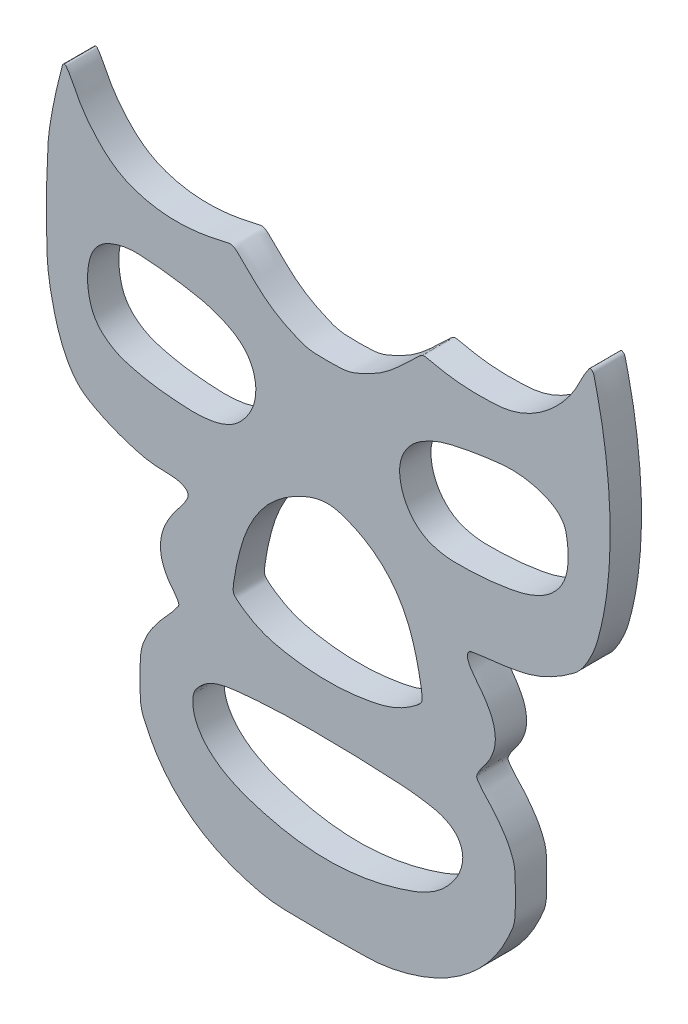
from build123d import *

# Parameters (mm, degrees)
SALIENTE_EXTRUIR1_DEPTH = 13.35


with BuildPart() as part:
    # Model → Saliente-Extruir1 (new body)
    with BuildSketch(Plane.XY):
        with BuildLine():
            add(Edge.make_bspline(
                [(222.846481332, 148.147186483), (222.536709077, 148.386586791), (222.204516886, 148.593757506), (221.853245507, 148.766615179), (221.711717214, 148.836260054), (221.423020896, 148.964089065), (220.975483271, 149.123087421), (220.675193386, 149.21993856), (220.524234777, 149.265678746), (219.991206869, 149.42718524), (219.449097539, 149.554937238), (218.900042065, 149.648431545), (218.685802756, 149.68491266), (218.255535917, 149.747373361), (217.60597105, 149.811386183), (217.172960146, 149.849203549), (216.956322036, 149.866445424), (216.210815314, 149.925779094), (215.463999221, 149.965357872), (214.716397142, 149.985154021), (214.467217046, 149.991752192), (213.968740397, 150.000550552), (213.220840298, 149.999433342), (212.722367477, 150.00851563), (212.473193095, 150.015326163), (210.318567976, 150.074217228), (208.17523573, 150.302262051), (206.056455528, 150.69804989), (205.448168119, 150.811677891), (204.236731513, 151.066440409), (202.436382527, 151.529274756), (201.243814997, 151.860425786), (200.649389202, 152.032422498), (198.69940477, 152.596649207), (196.770629947, 153.229593711), (194.865485528, 153.930461607), (194.547631813, 154.047394194), (193.913307046, 154.285017815), (192.965952326, 154.652737671), (192.337424452, 154.905295797), (192.023918064, 155.033428382), (191.725479931, 155.155402449), (191.129976621, 155.402709842), (190.2411528, 155.78455673), (189.651684237, 156.045924504), (189.357727321, 156.178334187), (187.591122301, 156.974082129), (185.85368078, 157.831639735), (184.147564521, 158.749940011), (183.663495386, 159.010485457), (182.70057355, 159.541267998), (181.262263363, 160.356691315), (180.346304567, 160.966376384), (179.901000222, 161.288728516), (178.794634159, 162.089617758), (177.771519607, 162.994441529), (176.841382319, 163.994598551), (176.58318174, 164.272236191), (176.081839011, 164.841515678), (175.37842205, 165.739326347), (174.932510942, 166.352774111), (174.714634814, 166.663064606), (174.189788951, 167.410529162), (173.69481098, 168.178098866), (173.230470106, 168.964580903), (173.067781921, 169.240135657), (172.750019771, 169.795740618), (172.296351214, 170.642489869), (172.004298156, 171.211991582), (171.86094321, 171.498081127), (171.409633193, 172.398748187), (170.984989011, 173.312290306), (170.587377545, 174.237918204), (170.44544698, 174.568328422), (170.168520579, 175.23212773), (169.773913152, 176.236662831), (169.521297155, 176.910070939), (169.397667199, 177.247755453), (169.002046021, 178.328360428), (168.633970214, 179.418655539), (168.293676778, 180.517938762), (168.170727248, 180.915114675), (167.932111825, 181.711721218), (167.595859546, 182.913165849), (167.379036031, 183.715952007), (167.272610218, 184.117870953), (166.928523551, 185.417320276), (166.60523814, 186.722100228), (166.302836483, 188.031877849), (166.252406018, 188.250304872), (166.152708933, 188.687427626), (166.006654486, 189.343920252), (165.911621293, 189.782080615), (165.864688692, 190.001285832), (165.826278311, 190.180686835), (165.750239876, 190.53965634), (165.639155192, 191.078748872), (165.566820585, 191.438483293), (165.531102686, 191.618439701), (165.316614583, 192.699088633), (165.118355265, 193.782832377), (164.936369317, 194.869427229), (164.906039747, 195.050517882), (164.846285804, 195.412850794), (164.759370319, 195.956806692), (164.703241655, 196.319718865), (164.675631006, 196.501243959), (164.650614285, 196.665715382), (164.601325731, 196.994771528), (164.531604535, 197.48899919), (164.487099056, 197.818737346), (164.465399997, 197.983679263), (164.335194641, 198.973414387), (164.224948876, 199.96557109), (164.134707423, 200.959746895), (164.119668451, 201.125428862), (164.090702838, 201.456893763), (164.050098983, 201.954362121), (164.026078892, 202.286220772), (164.014379998, 202.452172032), (163.999841823, 202.658399067), (163.971726491, 203.070920883), (163.932436541, 203.689908538), (163.908167121, 204.102674472), (163.896513346, 204.309084592), (163.826587846, 205.547595763), (163.773983112, 206.78696344), (163.738709425, 208.026945401), (163.732830716, 208.233600687), (163.722036308, 208.646938653), (163.707918967, 209.267017691), (163.701791907, 209.680450088), (163.698802995, 209.887167366), (163.693938369, 210.223611587), (163.684604439, 210.896505746), (163.671789503, 211.905864306), (163.664036892, 212.578778542), (163.660358255, 212.915237821), (163.638286374, 214.933998964), (163.623330719, 216.952825368), (163.615491476, 218.971691948), (163.614184791, 219.308207038), (163.611966868, 219.981238755), (163.609826331, 220.990791111), (163.609190211, 221.663826181), (163.609069877, 222.000343787), (163.608982297, 222.245264037), (163.609016608, 222.735104611), (163.610767407, 223.46986633), (163.612613003, 223.959703551), (163.613737866, 224.204621233), (163.620488128, 225.67436402), (163.634514914, 227.144055374), (163.655817881, 228.61365927), (163.659420768, 228.862207551), (163.667042779, 229.35929808), (163.679724523, 230.104916034), (163.689011425, 230.601978245), (163.693862978, 230.850505289), (163.698520191, 231.089077003), (163.708218143, 231.566212944), (163.724014602, 232.281892712), (163.735335147, 232.758992927), (163.741195937, 232.997538108), (163.776893748, 234.450506158), (163.820030191, 235.903272393), (163.870604133, 237.355798732), (163.87908548, 237.599390186), (163.896466485, 238.086558531), (163.923792937, 238.817267622), (163.942847028, 239.304373398), (163.952583189, 239.547917926), (163.960902174, 239.756012619), (163.977845481, 240.172189798), (164.004375076, 240.796411212), (164.022718813, 241.212529044), (164.032061159, 241.420580305), (164.088520857, 242.677920994), (164.151206138, 243.934966681), (164.220115465, 245.191686542), (164.23160102, 245.401152035), (164.254917908, 245.820064062), (164.290930586, 246.448375436), (164.31563039, 246.867208198), (164.328153131, 247.076614244), (164.335528953, 247.199953199), (164.350400519, 247.446623938), (164.377352412, 247.816354756), (164.396595649, 248.062724622), (164.406665953, 248.185872864), (164.467100285, 248.924915285), (164.543676951, 249.662459876), (164.636359349, 250.398154093), (164.667249769, 250.643356028), (164.732604448, 251.133309666), (164.841691927, 251.866745321), (164.915790704, 252.355440381), (164.953242741, 252.59972618), (165.260963807, 254.606876994), (165.595837517, 256.609676596), (165.957802457, 258.607757682), (166.005361837, 258.870290009), (166.10141491, 259.395185406), (166.248297749, 260.182021967), (166.348084431, 260.706220392), (166.398443999, 260.968229994), (166.447277664, 261.222300667), (166.545821796, 261.730273487), (166.696902519, 262.491606755), (166.799524098, 262.998771783), (166.851329531, 263.252253204), (167.162171006, 264.773185164), (167.490798547, 266.290373481), (167.837167103, 267.803610169), (167.894893548, 268.055809082), (168.011330718, 268.559981614), (168.188375605, 269.315702042), (168.309308556, 269.818814298), (168.369984003, 270.070320012), (168.424679691, 270.297039035), (168.534410689, 270.750395148), (168.700026104, 271.430183706), (168.811114854, 271.883209033), (168.866828854, 272.109679966), (169.341785264, 274.040322549), (169.829059178, 275.967893172), (170.328630729, 277.89231325), (170.347126168, 277.96356029), (170.384150731, 278.106045626), (170.439251303, 278.324842836), (170.50820165, 278.4559743), (170.549557473, 278.516866975), (170.677191289, 278.704796119), (170.860445905, 278.839055198), (171.078107639, 278.904102288), (171.130951177, 278.919894308), (171.239312313, 278.942530364), (171.411867213, 278.949723204), (171.521299138, 278.931238444), (171.574337198, 278.916112586), (171.683476333, 278.884987333), (171.782848463, 278.83016661), (171.867385742, 278.7544462), (171.895217929, 278.729516789), (171.947135331, 278.675474699), (172.011812667, 278.582601016), (172.054701767, 278.521404935), (172.076104236, 278.490777489), (172.343378065, 278.108302235), (172.604050719, 277.721297859), (172.858045466, 277.329878279), (172.928653411, 277.221067634), (173.068831307, 277.002772783), (173.275971572, 276.673289395), (173.411675338, 276.452184555), (173.478936521, 276.341273909), (173.701827745, 275.973736367), (173.918198232, 275.602322642), (174.127980593, 275.227148411), (174.202931727, 275.093105999), (174.351143538, 274.824075939), (174.568405846, 274.417733612), (174.711350396, 274.145872794), (174.78231986, 274.009680371), (175.009529666, 273.57365828), (175.231570181, 273.134981213), (175.448410386, 272.693710452), (175.520689718, 272.546621694), (175.664089364, 272.251874637), (175.875367373, 271.807899834), (176.019496015, 271.513506508), (176.092320188, 271.366686739), (176.705352573, 270.130760947), (177.371614454, 268.922697879), (178.089842245, 267.744788668), (178.283820078, 267.426660798), (178.679262152, 266.794969882), (179.294939046, 265.861267139), (179.716342143, 265.246615015), (179.929848148, 264.94124978), (180.590413858, 263.99648102), (181.277550604, 263.0708579), (181.9907038, 262.165127484), (182.226140605, 261.866114205), (182.702624012, 261.272504683), (183.434204758, 260.395275571), (183.932986811, 259.820272382), (184.185142121, 259.53521602), (184.934692387, 258.687864947), (185.708350331, 257.86246636), (186.505473314, 257.059705877), (186.757940365, 256.805453301), (187.267517046, 256.301558123), (188.045490089, 255.558783104), (188.577352598, 255.078411815), (188.846556459, 254.841951955), (189.612441375, 254.169223713), (190.404207844, 253.527157635), (191.220629125, 252.916748523), (191.570521213, 252.65514667), (192.279134344, 252.143751678), (193.369355374, 251.412538784), (194.112803865, 250.953209258), (194.488632763, 250.730470303), (195.869030771, 249.91236288), (197.30156224, 249.189416127), (198.779676817, 248.564935771), (199.296250694, 248.346691364), (200.339723492, 247.934641421), (201.935138385, 247.390514055), (203.007615475, 247.061820778), (203.546373181, 246.906195178), (205.241128888, 246.416647889), (206.958596069, 246.013957015), (208.694326402, 245.699165546), (208.983458657, 245.646728617), (209.562612716, 245.546759649), (210.433944477, 245.410745014), (211.016257327, 245.331260619), (211.307682996, 245.293602001), (211.624545443, 245.25265639), (212.25890693, 245.175691524), (213.212388488, 245.07502629), (213.848836392, 245.017823562), (214.167263439, 244.991697539), (216.078692186, 244.834870312), (217.995354538, 244.76734211), (219.91308086, 244.789259841), (220.232557026, 244.79291114), (220.871452592, 244.805180732), (221.829718295, 244.8373954), (222.467859628, 244.870622223), (222.786818003, 244.889167), (223.126362864, 244.90890871), (223.805198074, 244.952769575), (224.822708257, 245.03169853), (225.500186877, 245.093047849), (225.83871439, 245.125904673), (227.870512735, 245.323107081), (229.893165811, 245.598729721), (231.903648022, 245.952360302), (232.238629068, 246.011281262), (232.907831534, 246.133441856), (233.910302562, 246.325360406), (234.575206651, 246.469021384), (234.907658695, 246.540851873), (235.133785757, 246.589709498), (235.58603988, 246.687424749), (236.264421065, 246.833997624), (236.716675188, 246.931712875), (236.94280225, 246.9805705), (238.299595083, 247.273722833), (239.656387917, 247.566875167), (241.01318075, 247.8600275), (241.475790308, 247.959980174), (242.401009423, 248.159885521), (243.99342498, 247.380079765), (244.671796827, 246.719925088), (245.01098275, 246.38984775), (246.31939125, 245.116575583), (247.62779975, 243.843303417), (248.93620825, 242.57003125), (249.154282334, 242.357813383), (249.590430501, 241.933377649), (250.244652752, 241.296724048), (250.680800919, 240.872288314), (250.898875003, 240.660070447), (251.01145793, 240.550510851), (251.236623783, 240.331391658), (251.577062439, 240.005475291), (251.804659347, 239.788881152), (251.918698869, 239.680838531), (252.602998021, 239.032524045), (253.29591535, 238.393428921), (253.997326657, 237.763667713), (254.212003747, 237.570920173), (254.642937599, 237.187184491), (255.293669034, 236.61625111), (255.733592483, 236.242831924), (255.955092724, 236.057965728), (256.560535767, 235.552657241), (257.177314987, 235.061249733), (257.805111288, 234.583997441), (258.007609468, 234.430057826), (258.414864883, 234.125150245), (259.032500561, 233.676576208), (259.44921387, 233.384718946), (259.658804559, 233.24058477), (260.266800827, 232.822469628), (260.884991982, 232.419580772), (261.512996791, 232.03216666), (261.729003317, 231.898912941), (262.163293054, 231.636096045), (262.82155855, 231.253005672), (263.263590223, 231.003444186), (263.485427714, 230.880141709), (264.171724703, 230.498681757), (264.865738769, 230.131449229), (265.567175007, 229.778600173), (265.815629823, 229.653617968), (266.314364745, 229.407282095), (267.067862468, 229.04866478), (267.571811776, 228.813205534), (267.824235396, 228.69644654), (268.626275047, 228.325461675), (269.432787196, 227.964303087), (270.24365146, 227.613024683), (270.464688261, 227.517268268), (270.90739969, 227.327227753), (271.57229888, 227.043280603), (272.021331197, 226.868466185), (272.247427181, 226.785356835), (272.77495013, 226.591447646), (273.310549193, 226.421110099), (273.853171679, 226.274678982), (274.034842293, 226.225653681), (274.399639466, 226.132998302), (274.951255691, 226.010233913), (275.32084489, 225.939072442), (275.506113389, 225.906159294), (276.0650694, 225.806860158), (276.627809309, 225.731920615), (277.193272025, 225.68148197), (277.438504015, 225.65960755), (277.929792194, 225.62509874), (278.668177839, 225.596649716), (279.160250173, 225.578319552), (279.406312238, 225.569912471), (280.315686537, 225.538842332), (281.225355616, 225.518126761), (282.135201578, 225.507768444), (282.437738448, 225.504324155), (283.042838265, 225.49972614), (283.950572475, 225.499702624), (284.555672644, 225.504249563), (284.858209855, 225.507663764), (285.763663873, 225.517882018), (286.668944935, 225.53831702), (287.573937764, 225.568966167), (287.819037674, 225.577266899), (288.309186754, 225.595366542), (289.044677107, 225.623500217), (289.534061614, 225.657513539), (289.778354771, 225.679047723), (290.342465525, 225.728773492), (290.903933328, 225.802580679), (291.46173064, 225.900334211), (291.645821316, 225.932595954), (292.013091336, 226.002319636), (292.56135487, 226.122502538), (292.923955466, 226.213457646), (293.104535409, 226.261635243), (293.641542706, 226.404905426), (294.171653368, 226.571896052), (294.693820186, 226.76227724), (294.915095682, 226.842953933), (295.35460639, 227.012646035), (296.005447892, 227.288543678), (296.438688215, 227.473454157), (296.654979165, 227.566673248), (297.442684972, 227.906166046), (298.225959437, 228.2557614), (299.004672997, 228.615401483), (299.134454116, 228.675339431), (299.393759397, 228.795771706), (299.781947311, 228.978089732), (300.040210459, 229.100740896), (300.169209986, 229.162342994), (300.283155251, 229.216756117), (300.51083973, 229.326013848), (300.850696814, 229.493402639), (301.076562974, 229.606374204), (301.189288196, 229.663271791), (301.865707231, 230.004691486), (302.53448063, 230.360854736), (303.195287082, 230.731590426), (303.413724242, 230.854141364), (303.848822475, 231.102408972), (304.49618625, 231.484297464), (304.923653211, 231.745489208), (305.136363279, 231.877731231), (305.769357491, 232.27126425), (306.393122428, 232.679268188), (307.007327329, 233.101526697), (307.220040884, 233.247764716), (307.643135258, 233.543633884), (308.270751486, 233.997631684), (308.68499485, 234.305763144), (308.891068992, 234.461217518), (309.532679374, 234.945223606), (310.163995388, 235.442582496), (310.784739194, 235.9530753), (310.888187009, 236.038149633), (311.094487727, 236.209021694), (311.402432989, 236.467178731), (311.606046728, 236.64124216), (311.707687001, 236.728468001), (311.826015092, 236.830015024), (312.062219691, 237.03363528), (312.415172667, 237.340645103), (312.649556912, 237.546358124), (312.766519753, 237.649474703), (313.468322823, 238.268197121), (314.161809178, 238.896227101), (314.846855387, 239.533452863), (314.961032158, 239.639659391), (315.188913367, 239.852580225), (315.529798044, 240.172984222), (315.755297333, 240.388424972), (315.868046978, 240.496145347), (316.09108398, 240.709233642), (316.537157985, 241.135410231), (317.206268993, 241.774675116), (317.652342998, 242.200851705), (317.87538, 242.41394), (319.213641333, 243.692507333), (320.551902667, 244.971074667), (321.890164, 246.249642), (322.228139412, 246.572541803), (322.904090235, 247.218341409), (324.438867628, 248.055547342), (325.354357543, 247.866219947), (325.8121025, 247.77155625), (327.088466833, 247.507598417), (328.364831167, 247.243640583), (329.6411955, 246.97968275), (329.853929416, 246.935688428), (330.279397247, 246.847699784), (330.917598994, 246.715716818), (331.343066825, 246.627728174), (331.555800741, 246.583733852), (331.77378118, 246.538654526), (332.209742059, 246.448495873), (332.866136746, 246.325081062), (333.304193205, 246.245697007), (333.523411828, 246.207085961), (334.839002896, 245.975370486), (336.160873206, 245.782676939), (337.487865584, 245.629174007), (337.708912503, 245.60360389), (338.151258437, 245.554642944), (338.815476102, 245.486973832), (339.258767111, 245.447509895), (339.48047358, 245.428488519), (339.727618058, 245.407284682), (340.222058529, 245.366643028), (340.964178559, 245.310978711), (341.459149359, 245.277407434), (341.706691571, 245.261506227), (343.191615919, 245.166120113), (344.678243322, 245.102576463), (346.165891033, 245.070904459), (346.414179154, 245.065618408), (346.910793212, 245.056822586), (347.655832525, 245.048958108), (348.152521599, 245.04726883), (348.400865979, 245.047312534), (348.634726285, 245.047353688), (349.10244662, 245.049011483), (349.804030741, 245.056849379), (350.271676692, 245.065375477), (350.505481228, 245.070482671), (351.91066959, 245.101177412), (353.314861244, 245.162351742), (354.717395143, 245.253976863), (355.127581337, 245.28077362), (355.94761361, 245.339573375), (357.177627863, 245.439549216), (357.994258757, 245.535696692), (358.401505788, 245.591559342), (359.453553416, 245.735870201), (360.497193951, 245.931942301), (361.52988231, 246.179297489), (361.947452182, 246.279316119), (362.778595543, 246.496037961), (364.013405945, 246.870502059), (364.826282148, 247.147868128), (365.230166584, 247.29362713), (366.657183851, 247.808627449), (368.049632844, 248.410864453), (369.402186496, 249.098034174), (369.868288847, 249.334839141), (370.790390595, 249.828334686), (372.142631657, 250.628368769), (373.025211964, 251.189308678), (373.461821735, 251.476884585), (374.817272647, 252.369661275), (376.125924681, 253.329727546), (377.384440494, 254.354635025), (377.81092077, 254.701951142), (378.651987692, 255.411187932), (379.877826407, 256.51907342), (380.670115535, 257.282383885), (381.060058741, 257.670273311), (382.250944266, 258.8548866), (383.382618167, 260.096188803), (384.452385278, 261.391223669), (384.808375123, 261.82217659), (385.506350695, 262.695650571), (386.511381119, 264.040806995), (387.150906809, 264.95794291), (387.463082445, 265.421619048), (388.730751618, 267.304494837), (389.870700109, 269.26733049), (390.877904082, 271.301475647), (390.950662693, 271.448418649), (391.094769262, 271.743003135), (391.306350945, 272.187102041), (391.450064177, 272.481877532), (391.522528848, 272.628965712), (391.73991989, 273.070224219), (391.962766282, 273.508752919), (392.191033754, 273.94448437), (392.261663057, 274.07930607), (392.403956355, 274.348407426), (392.620274094, 274.750595602), (392.768222198, 275.01663618), (392.84313709, 275.149124475), (393.05054715, 275.515932792), (393.265127921, 275.878592918), (393.486796472, 276.236964691), (393.553131892, 276.344209233), (393.687064695, 276.557917739), (393.891782647, 276.876120793), (394.030558813, 277.086715639), (394.10051948, 277.191631248), (394.351755231, 277.568393693), (394.610325828, 277.940160541), (394.876131968, 278.306789016), (394.895688034, 278.333762849), (394.934877953, 278.387654118), (394.994291507, 278.470093931), (395.043751413, 278.515226995), (395.070446889, 278.53516136), (395.152273751, 278.596264094), (395.248425583, 278.630673464), (395.350441275, 278.635361537), (395.383717639, 278.636890733), (395.450571873, 278.633388146), (395.54933571, 278.607413965), (395.612930558, 278.587482871), (395.644450936, 278.576706943), (396.10296074, 278.419955381), (396.475127816, 278.109642701), (396.711759254, 277.686785922), (396.768317781, 277.585716695), (396.863366033, 277.373466906), (396.944976081, 277.030893864), (396.999931001, 276.805870766), (397.027349116, 276.693344758), (397.539176779, 274.592765472), (398.030299953, 272.487249165), (398.500671038, 270.376999905), (398.557169125, 270.123529721), (398.669565826, 269.616455732), (398.836362561, 268.855443349), (398.946359486, 268.347843383), (399.001057745, 268.093978718), (399.064347757, 267.800238154), (399.190123945, 267.212583831), (399.373324442, 266.329922651), (399.493103279, 265.74101558), (399.552311486, 265.446425131), (399.907718275, 263.678098569), (400.238547053, 261.905009419), (400.544734083, 260.127499274), (400.595733887, 259.831429682), (400.696364467, 259.239054675), (400.843552584, 258.34983745), (400.938351789, 257.756502032), (400.9852394, 257.459753426), (401.035747834, 257.140088879), (401.135576461, 256.500572037), (401.281754854, 255.540731861), (401.376826374, 254.900490538), (401.423767004, 254.580282633), (401.705267764, 252.660010853), (401.96534902, 250.736720929), (402.203978464, 248.810651777), (402.243805633, 248.48919152), (402.322263995, 247.846122831), (402.436363722, 246.881073593), (402.510034906, 246.237438906), (402.54627172, 245.915554155), (402.582406372, 245.59457689), (402.653484863, 244.952488304), (402.755199603, 243.988801045), (402.820302676, 243.346078604), (402.852137103, 243.024646362), (403.347321378, 238.024770189), (403.668766995, 233.010725721), (403.816087035, 227.988548303), (403.835615476, 227.322818818), (403.868547451, 225.991180182), (403.8995684, 223.993162019), (403.907992001, 222.661142869), (403.909140035, 221.995128013), (403.910227819, 221.364066536), (403.906902141, 220.101934099), (403.878162357, 218.208666911), (403.846248809, 216.946927201), (403.826884663, 216.316161951), (403.710662067, 212.530341883), (403.471798457, 208.750277671), (403.110544817, 204.979941203), (403.050349059, 204.351689366), (402.923169235, 203.095836112), (402.712027484, 201.21398043), (402.557738384, 199.961168801), (402.477212004, 199.335198034), (402.407471095, 198.793067985), (402.262916093, 197.709460515), (402.023244427, 196.086958131), (401.851540476, 195.007312233), (401.762477113, 194.46801964), (401.22795477, 191.231403232), (400.578151356, 188.015947522), (399.81389638, 184.825757209), (399.591516508, 183.897488328), (399.127450602, 182.045575629), (398.387746149, 179.273110007), (397.78321846, 177.461212922), (397.451743935, 176.566081333), (396.318691996, 173.506327092), (394.852757291, 170.591376295), (393.072085708, 167.857311295), (392.919278349, 167.622689001), (392.609171895, 167.15636984), (392.130835829, 166.464299857), (391.789549526, 166.020111402), (391.61356165, 165.80233634), (391.084895596, 165.148141944), (390.509519638, 164.534626979), (389.89055411, 163.965118613), (389.644661344, 163.7388734), (389.139623108, 163.30078657), (388.346867616, 162.684836403), (387.8147835, 162.280464286), (387.547109818, 162.080461915), (386.613431811, 161.382829582), (385.660285121, 160.712041331), (384.6884413, 160.06864015), (384.526702306, 159.961562183), (384.202210114, 159.748938182), (383.712515042, 159.434447585), (383.383961712, 159.228155916), (383.219245536, 159.12571679), (383.040234311, 159.014387387), (382.681173646, 158.793397973), (382.139461657, 158.466919213), (381.776341744, 158.252665131), (381.594286233, 158.146386981), (380.503066101, 157.509367774), (379.394473003, 156.903087153), (378.269372592, 156.328018538), (378.081820759, 156.232155829), (377.705823856, 156.042177994), (377.139142256, 155.762451723), (376.759670292, 155.579513817), (376.56951229, 155.488930797), (376.394439987, 155.405533949), (376.043579947, 155.240242139), (375.513610162, 155.000005295), (375.158653095, 154.84369731), (374.980715929, 154.766601846), (373.612451306, 154.173769007), (372.218517042, 153.644102958), (370.801827496, 153.178711095), (370.640083579, 153.125577151), (370.316040743, 153.020998735), (369.828301493, 152.869112346), (369.501770766, 152.772567973), (369.338169663, 152.725461819), (368.847309072, 152.584126864), (368.353538794, 152.453319364), (367.857084583, 152.333099124), (367.662267888, 152.285922749), (367.271842729, 152.194839637), (366.68408236, 152.067386126), (366.291988878, 151.983837524), (366.095836806, 151.942563803), (365.418690216, 151.800080682), (364.740314675, 151.66356852), (364.060762833, 151.533037912), (363.947506027, 151.511283162), (363.72092853, 151.468106252), (363.380875307, 151.404311018), (363.154043112, 151.362493019), (363.040599024, 151.341737004), (362.918651533, 151.319425186), (362.674691864, 151.275155104), (362.308557911, 151.209810598), (362.064345644, 151.166955861), (361.942208705, 151.145705546), (361.209375539, 151.018201645), (360.475461105, 150.897076509), (359.740520925, 150.782339301), (359.504973914, 150.745566232), (359.033674872, 150.673333342), (358.326112842, 150.568817977), (357.853904654, 150.502777168), (357.617677295, 150.470663497), (356.937329915, 150.378174413), (356.2560017, 150.293211761), (355.573775911, 150.215785924), (355.35662834, 150.191141836), (354.92215977, 150.143381794), (354.269909378, 150.076842395), (353.835242927, 150.030937473), (353.617950732, 150.007602935), (352.996855601, 149.940904874), (352.376103534, 149.871086071), (351.755710212, 149.798148289), (351.652311868, 149.785992056), (351.445535545, 149.761506365), (351.135432049, 149.724258137), (350.928738929, 149.699079752), (350.825402988, 149.686403998), (350.73348656, 149.675129026), (350.549670507, 149.652442108), (350.274051648, 149.61755235), (350.090355902, 149.593910435), (349.998522206, 149.581980351), (349.447514187, 149.510399087), (348.897030534, 149.434891055), (348.347099231, 149.355460094), (348.255474663, 149.342226027), (348.07225697, 149.315540207), (347.797515391, 149.274918834), (347.614435736, 149.247302298), (347.522907825, 149.233415484), (347.446123334, 149.221765573), (347.292571127, 149.19835519), (347.062293079, 149.162907925), (346.908808925, 149.139055446), (346.832075473, 149.127073963), (346.208411422, 149.029692444), (345.585327863, 148.928663306), (344.962846128, 148.82399001), (344.918494002, 148.816531987), (344.829795968, 148.801578958), (344.696477896, 148.779347232), (344.608896507, 148.758640192), (344.565483182, 148.746892151), (344.434951518, 148.711569092), (344.308427294, 148.663842217), (344.187086164, 148.604155), (344.146738391, 148.584308091), (344.067317609, 148.542022745), (343.951912935, 148.47072129), (343.878861153, 148.418179664), (343.843293633, 148.390669773), (343.561896217, 148.173021417), (343.349375536, 147.887731612), (343.22138134, 147.555808732), (343.183956744, 147.458756834), (343.124750277, 147.258620981), (343.083528889, 146.944420069), (343.068610638, 146.736799007), (343.064697752, 146.632854981), (343.051591683, 146.284698269), (343.078183406, 145.937311244), (343.144127557, 145.595205655), (343.170850458, 145.456572375), (343.237135773, 145.181780755), (343.371994952, 144.778205557), (343.46989577, 144.513292701), (343.521404189, 144.381838593), (343.704186132, 143.915362672), (343.918693668, 143.462598339), (344.163905983, 143.025700245), (344.259061751, 142.856159928), (344.458459418, 142.522178951), (344.782776681, 142.036426772), (345.002850235, 141.715844073), (345.11427513, 141.55652354), (345.49624323, 141.010367665), (345.894348516, 140.475860368), (346.308235981, 139.95347829), (346.446179004, 139.7793755), (346.725531244, 139.433916211), (347.155544624, 138.924737334), (347.436950427, 138.580963304), (347.576449481, 138.408104769), (348.930324629, 136.730467059), (350.167892484, 134.965283782), (351.283509935, 133.12060389), (351.541824778, 132.693478807), (352.045085219, 131.831143247), (352.767169352, 130.513831035), (353.184169685, 129.606041423), (353.375886597, 129.145165062), (353.89118739, 127.906411778), (354.283166603, 126.62329179), (354.548083842, 125.308049052), (354.632206307, 124.890403671), (354.77448963, 124.049883701), (354.91121812, 122.771226606), (354.934952477, 121.918836275), (354.930120569, 121.492830517), (354.916238943, 120.268955071), (354.765196871, 119.054356331), (354.478899849, 117.864357247), (354.379212506, 117.450004887), (354.147342412, 116.629118105), (353.701709995, 115.423334262), (353.364490611, 114.640187577), (353.185397755, 114.253469084), (352.405300015, 112.568989715), (351.4326285, 110.987871961), (350.280866245, 109.532033051), (350.215642707, 109.449589852), (350.08409309, 109.28557571), (349.88321062, 109.042429478), (349.75171295, 108.878373391), (349.686528918, 108.795898953), (349.490987584, 108.548489252), (349.300569465, 108.2971152), (349.115354911, 108.041882869), (349.054874859, 107.958539178), (348.935032945, 107.791040359), (348.758579823, 107.53736486), (348.643673445, 107.366440284), (348.586900078, 107.280528747), (348.42006857, 107.028073199), (348.259151421, 106.771807269), (348.10423562, 106.511869487), (348.056620319, 106.431974373), (347.96253175, 106.271503526), (347.824753647, 106.02877333), (347.735672059, 105.865467645), (347.691827322, 105.783442739), (347.571359814, 105.55807165), (347.456178818, 105.329953508), (347.346346937, 105.099212297), (347.317374386, 105.038345075), (347.26017801, 104.916254239), (347.173998833, 104.732782716), (347.126044509, 104.606614649), (347.105113954, 104.542535484), (347.058699675, 104.400437572), (347.027468513, 104.254250306), (347.011766027, 104.105591186), (347.006285165, 104.053702583), (346.999142469, 103.949521983), (347.000003836, 103.791617487), (347.010338058, 103.687665309), (347.017877077, 103.636035568), (347.041755023, 103.472511331), (347.089009658, 103.314153093), (347.158649257, 103.164284288), (347.181744147, 103.114582629), (347.232730604, 103.017408184), (347.323712574, 102.87965341), (347.384221275, 102.788257118), (347.414585346, 102.742631993), (347.67926393, 102.344925321), (347.952220061, 101.952853518), (348.233333818, 101.566588836), (348.31459791, 101.454927816), (348.478479383, 101.232590666), (348.728353458, 100.902030395), (348.89739286, 100.683589786), (348.982531856, 100.574854385), (349.263265598, 100.216314852), (349.550682386, 99.863110067), (349.844680867, 99.51536458), (349.947471644, 99.393782221), (350.154649823, 99.151967356), (350.47020106, 98.793316332), (350.682620005, 98.556096772), (350.789363526, 98.437969575), (351.124578898, 98.067005117), (351.465026911, 97.700836951), (351.810638946, 97.339538879), (351.933007324, 97.211616659), (352.179030162, 96.957002466), (352.551850691, 96.578733205), (352.796288945, 96.32259132), (352.917596342, 96.193662542), (353.302881695, 95.784170861), (353.678874206, 95.366130346), (354.045384242, 94.939751837), (354.176603089, 94.787098728), (354.436585748, 94.479682189), (354.819204273, 94.012309003), (355.071525665, 93.698584878), (355.196956694, 93.541141508), (355.59928685, 93.036129183), (355.994065872, 92.525192273), (356.38120653, 92.008443675), (356.445727003, 91.922322873), (356.574341227, 91.749761576), (356.765982931, 91.489959711), (356.892880786, 91.316132342), (356.956114, 91.229062), (357.017791511, 91.144133816), (357.140736075, 90.97397936), (357.323847509, 90.71779844), (357.445073725, 90.546415459), (357.505472617, 90.460573246), (357.867882898, 89.945495909), (358.222540652, 89.425050184), (358.569366371, 88.899352747), (358.673968655, 88.740802934), (358.88174121, 88.422758546), (359.189765719, 87.94316779), (359.388561767, 87.619417121), (359.48626404, 87.456524681), (359.748621274, 87.019114081), (359.998651683, 86.574542213), (360.236159946, 86.123156373), (360.328762702, 85.947164296), (360.510131866, 85.593161549), (360.7710636, 85.056418214), (360.940824645, 84.696721841), (361.024560803, 84.516342415), (361.312312091, 83.896485788), (361.586483486, 83.270504088), (361.846944702, 82.638694784), (361.923076053, 82.454020473), (362.07298512, 82.083701573), (362.292701875, 81.525709333), (362.425471668, 81.148835385), (362.488196201, 80.959187773), (362.650113735, 80.469630147), (362.787459253, 79.972618914), (362.899892164, 79.469386565), (362.940743867, 79.286540649), (363.015827164, 78.919369743), (363.108738625, 78.364460351), (363.163001137, 77.993679497), (363.18809545, 77.808013759), (363.269687684, 77.204335866), (363.329703106, 76.598132567), (363.368065391, 75.990174817), (363.386054859, 75.705081361), (363.412495919, 75.134292608), (363.430406303, 74.277285105), (363.443135326, 73.706105108), (363.448995002, 73.420504752), (363.471662732, 72.315680535), (363.486775321, 71.210727149), (363.494332062, 70.105696257), (363.495591506, 69.921526238), (363.497690618, 69.553183329), (363.49959215, 69.000659994), (363.499999999, 68.632311343), (363.5, 68.448137017), (363.500000001, 68.253330961), (363.499543712, 67.863718848), (363.497490386, 67.279300279), (363.495208933, 66.889694579), (363.493840066, 66.694893332), (363.485626779, 65.526073839), (363.469200603, 64.357340916), (363.444562349, 63.188752271), (363.438337747, 62.893520344), (363.424840302, 62.303078592), (363.407133367, 61.417067574), (363.377564574, 60.827081884), (363.356573317, 60.532531373), (363.31368722, 59.930751234), (363.244949173, 59.331373527), (363.150486479, 58.735508313), (363.120217991, 58.54457644), (363.054413216, 58.163547799), (362.940165798, 57.594223089), (362.850464396, 57.218076017), (362.802248089, 57.030869315), (362.663207885, 56.491025842), (362.496392382, 55.959108797), (362.302249425, 55.436546202), (362.216971539, 55.207008991), (362.035961682, 54.751818481), (361.738853416, 54.079504648), (361.540522216, 53.631725469), (361.440584337, 53.408181134), (361.068260875, 52.575355762), (360.685249841, 51.747391145), (360.291614678, 50.924424427), (360.22601108, 50.787268036), (360.094215472, 50.513236697), (359.894756317, 50.103033104), (359.760614338, 49.830142676), (359.693250979, 49.693841958), (359.625878046, 49.557521868), (359.490547274, 49.285170764), (359.283318606, 48.878732266), (359.143421178, 48.60869679), (359.072960949, 48.47394652), (357.536914987, 45.536365853), (355.763570397, 42.735639814), (353.765036899, 40.090893847), (353.258263184, 39.420258234), (352.216570294, 38.100255457), (350.569008036, 36.184076652), (349.422132165, 34.954394725), (348.836504234, 34.351392528), (347.069202435, 32.531658851), (345.194306842, 30.822988953), (343.218784545, 29.23173223), (342.549346158, 28.692508585), (341.188174706, 27.641739815), (339.079102413, 26.148951069), (337.638666393, 25.209872257), (336.909718299, 24.754301659), (334.681958197, 23.362018707), (332.376567745, 22.102438715), (330.001442695, 20.979875628), (329.605871054, 20.792915315), (328.811080631, 20.426711332), (327.60847828, 19.89908364), (326.799417183, 19.565627612), (326.39358599, 19.402127996), (325.96650447, 19.230067134), (325.10946059, 18.893096096), (323.815202891, 18.409084818), (322.947355936, 18.101001461), (322.512173387, 17.950602944), (319.899704607, 17.047737165), (317.245195329, 16.277191747), (314.555342867, 15.640910773), (314.107269815, 15.534919697), (313.209349088, 15.330439694), (311.857094306, 15.046226849), (310.952829981, 14.871929015), (310.499999981, 14.788570996), (310.231663189, 14.739174924), (309.694499517, 14.643045112), (308.886455444, 14.511243101), (308.346862795, 14.429814637), (308.076814998, 14.390842944), (306.456021993, 14.156939729), (304.827389576, 13.985951041), (303.19335898, 13.878133182), (302.92110558, 13.86016915), (302.376366947, 13.827754626), (301.558632537, 13.786502042), (301.013152506, 13.771331751), (300.740407779, 13.763919994), (300.235372776, 13.750195818), (299.225270458, 13.723936464), (297.710018999, 13.688114438), (296.699804235, 13.666611519), (296.194684897, 13.656454659), (293.163937223, 13.595512858), (290.132834721, 13.555978215), (287.101528595, 13.5378527), (286.596316131, 13.534831813), (285.58588409, 13.529979453), (284.070213567, 13.526198694), (283.059769956, 13.526174454), (282.554548757, 13.526722), (282.049380579, 13.527269489), (281.039045434, 13.529483564), (279.523545427, 13.536161999), (278.513230009, 13.542852435), (278.008076625, 13.546757185), (274.20709038, 13.576138163), (270.406481012, 13.637196369), (266.606512512, 13.72992756), (266.358096894, 13.735989683), (265.861272263, 13.748384625), (265.116055024, 13.767789133), (264.619258587, 13.781266818), (264.370864114, 13.788140997), (264.122469962, 13.795015167), (263.625689148, 13.80903418), (262.881052878, 13.850170657), (262.385132099, 13.882797333), (262.137310099, 13.900995289), (260.649732841, 14.010230407), (259.168687031, 14.187209831), (257.697256124, 14.431565098), (256.997488827, 14.54777295), (255.60299971, 14.810570945), (253.525873004, 15.284099133), (252.149345802, 15.62786114), (251.463225904, 15.807911192), (248.786419373, 16.510352788), (246.145103199, 17.336286364), (243.544971246, 18.28393146), (242.708822962, 18.588674387), (241.045630559, 19.223140081), (238.576294184, 20.248790959), (236.960769994, 20.996709056), (236.160755226, 21.386566176), (233.844102687, 22.515499695), (231.596173737, 23.77573194), (229.424402032, 25.163095461), (229.062532816, 25.394263475), (228.343227452, 25.863539006), (227.277527999, 26.588316983), (226.576749875, 27.084834607), (226.228773213, 27.336429963), (225.895743964, 27.577217987), (225.234104668, 28.064906149), (224.25726754, 28.818151228), (223.616297659, 29.33271484), (223.298439309, 29.593201735), (221.388968418, 31.158025006), (219.577667064, 32.835504769), (217.871171133, 34.619495406), (217.303566513, 35.212875858), (216.192267833, 36.422508673), (214.596880343, 38.306149388), (213.587059751, 39.601709169), (213.095501117, 40.259467085), (211.155157259, 42.855854256), (209.428619127, 45.599068923), (207.926941786, 48.471546215), (207.856507993, 48.606275203), (207.716653079, 48.876262585), (207.509467725, 49.282617446), (207.374126901, 49.554894079), (207.306748995, 49.69117701), (207.239380067, 49.827441783), (207.105227068, 50.10026048), (206.905751737, 50.510356952), (206.773945591, 50.784317183), (206.708336783, 50.921438097), (206.314670338, 51.744192008), (205.931630251, 52.571946536), (205.559280028, 53.404564444), (205.45933632, 53.628050066), (205.260993753, 54.075712175), (204.963867812, 54.747850616), (204.782851316, 55.20292837), (204.697571783, 55.432410329), (204.50342918, 55.954836086), (204.336621793, 56.486621116), (204.197597928, 57.026336215), (204.149383396, 57.213513508), (204.059688658, 57.589602774), (203.945461481, 58.158843523), (203.879668936, 58.539815574), (203.849406278, 58.730719088), (203.754954633, 59.326540875), (203.686228746, 59.925875062), (203.643355929, 60.527611413), (203.636213218, 60.627862093), (203.623366061, 60.828465927), (203.607090807, 61.129649854), (203.601325182, 61.330576808), (203.598503, 61.431041988), (203.593031024, 61.62583564), (203.582542946, 62.01543575), (203.568178453, 62.599874733), (203.559514044, 62.989519665), (203.555409815, 63.184346934), (203.530784192, 64.353322543), (203.514366351, 65.522442233), (203.506157102, 66.691648376), (203.504787426, 66.886725032), (203.502505105, 67.276881553), (203.500452726, 67.862126363), (203.499998566, 68.252289295), (203.500000007, 68.44737076), (203.500001322, 68.625495238), (203.500384993, 68.981744192), (203.502315642, 69.516117983), (203.504415968, 69.872360996), (203.505675883, 70.050481019), (203.5132444, 71.12047811), (203.528381698, 72.190394891), (203.551087019, 73.260177825), (203.55487139, 73.438482084), (203.562860586, 73.795081679), (203.576105766, 74.329954672), (203.58577665, 74.686512623), (203.590822283, 74.864785649), (203.593766043, 74.968795034), (203.599796657, 75.176809753), (203.614586209, 75.488673699), (203.626016942, 75.696464557), (203.632286047, 75.800326562), (203.669911945, 76.423685203), (203.727458349, 77.045521287), (203.804866363, 77.665198382), (203.828436051, 77.853881636), (203.879252154, 78.230788859), (203.96574965, 78.795122745), (204.035689123, 79.168989491), (204.07376758, 79.355287455), (204.177293704, 79.861786609), (204.303676197, 80.363071474), (204.45265516, 80.858111189), (204.507728503, 81.041113484), (204.624013477, 81.405270796), (204.816346091, 81.945804494), (204.949289618, 82.30417052), (205.017127247, 82.482834924), (205.240816325, 83.071966295), (205.479282222, 83.655272897), (205.732373442, 84.232384161), (205.807161925, 84.4029206), (205.959279564, 84.742879271), (206.194587583, 85.24981875), (206.359187563, 85.583930245), (206.443464847, 85.749982447), (206.664058108, 86.184619099), (206.898086615, 86.61217151), (207.145323116, 87.032224506), (207.239542644, 87.192302789), (207.431784459, 87.510221111), (207.730969201, 87.980536607), (207.932561771, 88.292582438), (208.034041193, 88.44815976), (208.376740102, 88.973548822), (208.727191475, 89.493798804), (209.085318262, 90.008795323), (209.20770763, 90.18479472), (209.454270157, 90.535553072), (209.82947543, 91.057965951), (210.082876602, 91.403815328), (210.210397463, 91.576132986), (210.602435772, 92.10589041), (211.002184274, 92.629854245), (211.409557362, 93.147912283), (211.538479316, 93.311862864), (211.797841864, 93.638569849), (212.191283888, 94.125233408), (212.458107606, 94.445883505), (212.592648214, 94.605255673), (212.974846288, 95.057994338), (213.36607473, 95.502952733), (213.766175196, 95.93995077), (213.892815552, 96.078269996), (214.147857979, 96.353295481), (214.536304359, 96.760326768), (214.793214718, 97.033601372), (214.921154205, 97.170719844), (215.284631118, 97.56027431), (215.643925131, 97.953690069), (215.998995228, 98.35092221), (216.111133695, 98.47637632), (216.334563943, 98.728041358), (216.667296043, 99.107725205), (216.88643265, 99.363141236), (216.995327254, 99.491421143), (217.303931745, 99.854963084), (217.6070917, 100.223057524), (217.90473997, 100.595622932), (217.995125131, 100.708757755), (218.174872811, 100.935844406), (218.441400912, 101.278947017), (218.617156703, 101.509136533), (218.704554778, 101.6245945), (219.016466623, 102.036648286), (219.322233236, 102.453282538), (219.621787363, 102.874405615), (219.649299049, 102.91308245), (219.704217052, 102.990511071), (219.787113062, 103.107066702), (219.833655396, 103.189943094), (219.85475428, 103.232459297), (219.918412687, 103.360736876), (219.961702568, 103.497241513), (219.983605272, 103.638761128), (219.990378153, 103.682522644), (219.9997518, 103.770691385), (220.000920172, 103.904834283), (219.994625487, 103.99324479), (219.989737282, 104.037256693), (219.976039606, 104.160586377), (219.948811618, 104.281650301), (219.908386117, 104.39896874), (219.889742937, 104.453072927), (219.846925401, 104.559375371), (219.770191989, 104.713423659), (219.719480245, 104.81603014), (219.693825837, 104.867183659), (219.59529728, 105.063644341), (219.49239071, 105.257847621), (219.385157817, 105.449695954), (219.345989054, 105.519772044), (219.266504078, 105.659282864), (219.143852289, 105.866629875), (219.06022925, 106.003698582), (219.017944268, 106.071939558), (218.879955768, 106.294630204), (218.736961536, 106.514140112), (218.589034858, 106.73035678), (218.538466352, 106.804270115), (218.436185187, 106.951314002), (218.279319711, 107.16951583), (218.172956484, 107.313632347), (218.119320609, 107.385350879), (217.954357303, 107.605929478), (217.785128797, 107.823253024), (217.611699303, 108.037239055), (217.553884824, 108.108573466), (217.43732936, 108.250491381), (217.259521663, 108.460905392), (217.142799886, 108.602685682), (217.084859523, 108.673917884), (215.854254229, 110.186830804), (214.821972076, 111.841426962), (214.004136968, 113.611862115), (213.816781863, 114.017445173), (213.465372032, 114.839374669), (213.00629225, 116.106461797), (212.766420206, 116.967855599), (212.662904352, 117.402463492), (212.36191582, 118.666153891), (212.201002491, 119.955190128), (212.182096599, 121.254093545), (212.175520836, 121.705872301), (212.196893843, 122.609932327), (212.333472472, 123.9665206), (212.477944067, 124.858977223), (212.563728549, 125.302585505), (212.833611856, 126.698204708), (213.235943837, 128.061553137), (213.767024108, 129.380091611), (213.961885078, 129.863882289), (214.385719783, 130.817723723), (215.120738396, 132.20470452), (215.636434742, 133.111599444), (215.901791169, 133.560609671), (217.113490943, 135.610929669), (218.477919466, 137.562944843), (219.987140888, 139.405301794), (220.067511412, 139.503412775), (220.229050345, 139.698981127), (220.474008509, 139.990148184), (220.634533057, 140.186554565), (220.714137729, 140.285287953), (220.95295779, 140.581495619), (221.185812247, 140.882415551), (221.412608144, 141.187927621), (221.486471385, 141.287427267), (221.632902846, 141.487387915), (221.848725224, 141.790200204), (221.989377309, 141.994270295), (222.05889876, 142.096850634), (222.262627191, 142.397456147), (222.459393624, 142.70266414), (222.649094128, 143.012313405), (222.707291193, 143.10730882), (222.822345618, 143.298120396), (222.990991529, 143.586777418), (223.100180173, 143.781007723), (223.153959794, 143.878571956), (223.301392668, 144.14603712), (223.442665175, 144.416806661), (223.5777033, 144.690738715), (223.613057791, 144.76245719), (223.682907101, 144.906317925), (223.788415253, 145.122394177), (223.847222114, 145.271320525), (223.872854872, 145.347059824), (223.928972103, 145.512874202), (223.96675626, 145.68380082), (223.9857607, 145.85781916), (223.994443728, 145.937327217), (224.003891048, 146.097208133), (223.993486074, 146.340200949), (223.969503464, 146.498580657), (223.953368511, 146.576917043), (223.890976909, 146.87983286), (223.768758995, 147.16393405), (223.591740397, 147.417538308), (223.525410956, 147.512564644), (223.378186111, 147.69245011), (223.11734904, 147.929139215), (222.938175885, 148.076322472), (222.846481332, 148.147186483)],
                knots=[0, 0, 0, 0, 0.001165914, 0.001165914, 0.001165914, 0.001637245, 0.002108575, 0.002579905, 0.002579905, 0.002579905, 0.004241966, 0.004241966, 0.004241966, 0.004891348, 0.00554073, 0.006190113, 0.006190113, 0.006190113, 0.00842428, 0.00842428, 0.00842428, 0.009169115, 0.009913949, 0.010658784, 0.010658784, 0.010658784, 0.017086132, 0.017086132, 0.017086132, 0.018935193, 0.020784254, 0.022633314, 0.022633314, 0.022633314, 0.028696529, 0.028696529, 0.028696529, 0.029708538, 0.030720546, 0.031732554, 0.031732554, 0.031732554, 0.032695922, 0.03365929, 0.034622657, 0.034622657, 0.034622657, 0.040409846, 0.040409846, 0.040409846, 0.042052501, 0.043695157, 0.045337813, 0.045337813, 0.045337813, 0.049406086, 0.049406086, 0.049406086, 0.050539005, 0.051671923, 0.052804842, 0.052804842, 0.052804842, 0.055532536, 0.055532536, 0.055532536, 0.056488717, 0.057444897, 0.058401077, 0.058401077, 0.058401077, 0.061410458, 0.061410458, 0.061410458, 0.062484989, 0.063559521, 0.064634052, 0.064634052, 0.064634052, 0.068071862, 0.068071862, 0.068071862, 0.069314224, 0.070556586, 0.071798949, 0.071798949, 0.071798949, 0.075815305, 0.075815305, 0.075815305, 0.076485156, 0.077155006, 0.077824857, 0.077824857, 0.077824857, 0.078373073, 0.07892129, 0.079469506, 0.079469506, 0.079469506, 0.082761331, 0.082761331, 0.082761331, 0.083309984, 0.083858637, 0.084407289, 0.084407289, 0.084407289, 0.084904398, 0.085401507, 0.085898616, 0.085898616, 0.085898616, 0.088881117, 0.088881117, 0.088881117, 0.089378226, 0.089875335, 0.090372444, 0.090372444, 0.090372444, 0.090990199, 0.091607954, 0.092225709, 0.092225709, 0.092225709, 0.095932151, 0.095932151, 0.095932151, 0.096549906, 0.097167662, 0.097785417, 0.097785417, 0.097785417, 0.098790849, 0.099796282, 0.100801714, 0.100801714, 0.100801714, 0.1068343, 0.1068343, 0.1068343, 0.107839846, 0.108845393, 0.10985094, 0.10985094, 0.10985094, 0.110582785, 0.11131463, 0.112046475, 0.112046475, 0.112046475, 0.116438216, 0.116438216, 0.116438216, 0.11718098, 0.117923744, 0.118666508, 0.118666508, 0.118666508, 0.119379519, 0.120092529, 0.12080554, 0.12080554, 0.12080554, 0.125148419, 0.125148419, 0.125148419, 0.125876734, 0.12660505, 0.127333365, 0.127333365, 0.127333365, 0.127955669, 0.128577972, 0.129200276, 0.129200276, 0.129200276, 0.132961084, 0.132961084, 0.132961084, 0.133587927, 0.13421477, 0.134841613, 0.134841613, 0.134841613, 0.13521082, 0.135580027, 0.135949234, 0.135949234, 0.135949234, 0.138164581, 0.138164581, 0.138164581, 0.138903059, 0.139641537, 0.140380015, 0.140380015, 0.140380015, 0.146447277, 0.146447277, 0.146447277, 0.147244517, 0.148041757, 0.148838997, 0.148838997, 0.148838997, 0.14961208, 0.150385164, 0.151158247, 0.151158247, 0.151158247, 0.155796668, 0.155796668, 0.155796668, 0.156569751, 0.157342835, 0.158115918, 0.158115918, 0.158115918, 0.158812811, 0.159509705, 0.160206599, 0.160206599, 0.160206599, 0.166147467, 0.166147467, 0.166147467, 0.166367417, 0.166587366, 0.166807315, 0.166807315, 0.166807315, 0.167459938, 0.167459938, 0.167459938, 0.167624739, 0.167789541, 0.167954343, 0.167954343, 0.167954343, 0.168287699, 0.168287699, 0.168287699, 0.168399348, 0.168510996, 0.168622645, 0.168622645, 0.168622645, 0.170016776, 0.170016776, 0.170016776, 0.170404368, 0.17079196, 0.171179552, 0.171179552, 0.171179552, 0.172463828, 0.172463828, 0.172463828, 0.172922723, 0.173381617, 0.173840512, 0.173840512, 0.173840512, 0.1753096, 0.1753096, 0.1753096, 0.175799314, 0.176289028, 0.176778743, 0.176778743, 0.176778743, 0.18089854, 0.18089854, 0.18089854, 0.182011912, 0.183125284, 0.184238656, 0.184238656, 0.184238656, 0.187682389, 0.187682389, 0.187682389, 0.188819591, 0.189956794, 0.191093996, 0.191093996, 0.191093996, 0.194473478, 0.194473478, 0.194473478, 0.195544134, 0.19661479, 0.197685445, 0.197685445, 0.197685445, 0.200729887, 0.200729887, 0.200729887, 0.202035312, 0.203340737, 0.204646162, 0.204646162, 0.204646162, 0.209433604, 0.209433604, 0.209433604, 0.211109282, 0.212784959, 0.214460636, 0.214460636, 0.214460636, 0.219727218, 0.219727218, 0.219727218, 0.220605266, 0.221483314, 0.222361362, 0.222361362, 0.222361362, 0.22331605, 0.224270737, 0.225225425, 0.225225425, 0.225225425, 0.230951992, 0.230951992, 0.230951992, 0.231906679, 0.232861366, 0.233816054, 0.233816054, 0.233816054, 0.23483236, 0.235848665, 0.236864971, 0.236864971, 0.236864971, 0.242961665, 0.242961665, 0.242961665, 0.243977987, 0.244994308, 0.246010629, 0.246010629, 0.246010629, 0.24670191, 0.247393191, 0.248084472, 0.248084472, 0.248084472, 0.25223225, 0.25223225, 0.25223225, 0.253646469, 0.255060688, 0.256474907, 0.256474907, 0.256474907, 0.261930251, 0.261930251, 0.261930251, 0.2628395, 0.263748749, 0.264657998, 0.264657998, 0.264657998, 0.265127407, 0.265596816, 0.266066224, 0.266066224, 0.266066224, 0.268882765, 0.268882765, 0.268882765, 0.269744859, 0.270606954, 0.271469048, 0.271469048, 0.271469048, 0.273825069, 0.273825069, 0.273825069, 0.274585144, 0.275345218, 0.276105293, 0.276105293, 0.276105293, 0.278309722, 0.278309722, 0.278309722, 0.279068106, 0.27982649, 0.280584874, 0.280584874, 0.280584874, 0.282930748, 0.282930748, 0.282930748, 0.283761795, 0.284592842, 0.285423889, 0.285423889, 0.285423889, 0.288064289, 0.288064289, 0.288064289, 0.288784082, 0.289503876, 0.290223669, 0.290223669, 0.290223669, 0.291901977, 0.291901977, 0.291901977, 0.292464245, 0.293026513, 0.293588781, 0.293588781, 0.293588781, 0.295284079, 0.295284079, 0.295284079, 0.296019765, 0.296755451, 0.297491137, 0.297491137, 0.297491137, 0.300209902, 0.300209902, 0.300209902, 0.301113969, 0.302018037, 0.302922104, 0.302922104, 0.302922104, 0.305627744, 0.305627744, 0.305627744, 0.306360546, 0.307093348, 0.307826149, 0.307826149, 0.307826149, 0.30951727, 0.30951727, 0.30951727, 0.310075733, 0.310634197, 0.311192661, 0.311192661, 0.311192661, 0.312852322, 0.312852322, 0.312852322, 0.31355609, 0.314259859, 0.314963627, 0.314963627, 0.314963627, 0.317526525, 0.317526525, 0.317526525, 0.317953684, 0.318380842, 0.318808001, 0.318808001, 0.318808001, 0.31918531, 0.319562619, 0.319939928, 0.319939928, 0.319939928, 0.322203647, 0.322203647, 0.322203647, 0.322952065, 0.323700483, 0.324448901, 0.324448901, 0.324448901, 0.326675691, 0.326675691, 0.326675691, 0.327447016, 0.328218342, 0.328989668, 0.328989668, 0.328989668, 0.331390833, 0.331390833, 0.331390833, 0.331791049, 0.332191265, 0.332591481, 0.332591481, 0.332591481, 0.333057407, 0.333523333, 0.333989258, 0.333989258, 0.333989258, 0.33678475, 0.33678475, 0.33678475, 0.337250703, 0.337716656, 0.338182609, 0.338182609, 0.338182609, 0.339104339, 0.340026068, 0.340947798, 0.340947798, 0.340947798, 0.34647834, 0.34647834, 0.34647834, 0.347875068, 0.349271796, 0.350668524, 0.350668524, 0.350668524, 0.354563124, 0.354563124, 0.354563124, 0.355212244, 0.355861364, 0.356510484, 0.356510484, 0.356510484, 0.357175613, 0.357840742, 0.358505871, 0.358505871, 0.358505871, 0.362496327, 0.362496327, 0.362496327, 0.363161241, 0.363826154, 0.364491068, 0.364491068, 0.364491068, 0.365232272, 0.365973476, 0.36671468, 0.36671468, 0.36671468, 0.37116024, 0.37116024, 0.37116024, 0.371902316, 0.372644393, 0.37338647, 0.37338647, 0.37338647, 0.374085266, 0.374784063, 0.37548286, 0.37548286, 0.37548286, 0.379682039, 0.379682039, 0.379682039, 0.380910327, 0.382138615, 0.383366903, 0.383366903, 0.383366903, 0.386537379, 0.386537379, 0.386537379, 0.387820411, 0.389103444, 0.390386476, 0.390386476, 0.390386476, 0.394913945, 0.394913945, 0.394913945, 0.396476144, 0.398038344, 0.399600543, 0.399600543, 0.399600543, 0.404446253, 0.404446253, 0.404446253, 0.406089743, 0.407733234, 0.409376724, 0.409376724, 0.409376724, 0.414391953, 0.414391953, 0.414391953, 0.416062213, 0.417732473, 0.419402734, 0.419402734, 0.419402734, 0.426175289, 0.426175289, 0.426175289, 0.426665246, 0.427155203, 0.42764516, 0.42764516, 0.42764516, 0.429114936, 0.429114936, 0.429114936, 0.429569729, 0.430024523, 0.430479316, 0.430479316, 0.430479316, 0.431738299, 0.431738299, 0.431738299, 0.432115105, 0.43249191, 0.432868716, 0.432868716, 0.432868716, 0.434221689, 0.434221689, 0.434221689, 0.434321243, 0.434420798, 0.434520353, 0.434520353, 0.434520353, 0.434816556, 0.434816556, 0.434816556, 0.434916094, 0.435015632, 0.43511517, 0.43511517, 0.43511517, 0.436499298, 0.436499298, 0.436499298, 0.436845373, 0.437191449, 0.437537525, 0.437537525, 0.437537525, 0.443997686, 0.443997686, 0.443997686, 0.444773666, 0.445549646, 0.446325626, 0.446325626, 0.446325626, 0.447223493, 0.448121361, 0.449019228, 0.449019228, 0.449019228, 0.454408475, 0.454408475, 0.454408475, 0.455306188, 0.456203902, 0.457101615, 0.457101615, 0.457101615, 0.458068653, 0.459035691, 0.460002729, 0.460002729, 0.460002729, 0.465801769, 0.465801769, 0.465801769, 0.466769667, 0.467737565, 0.468705463, 0.468705463, 0.468705463, 0.469670632, 0.470635801, 0.47160097, 0.47160097, 0.47160097, 0.486608145, 0.486608145, 0.486608145, 0.488598263, 0.490588382, 0.492578501, 0.492578501, 0.492578501, 0.494464175, 0.49634985, 0.498235524, 0.498235524, 0.498235524, 0.509549279, 0.509549279, 0.509549279, 0.511435153, 0.513321027, 0.5152069, 0.5152069, 0.5152069, 0.516840185, 0.518473471, 0.520106756, 0.520106756, 0.520106756, 0.529904903, 0.529904903, 0.529904903, 0.532757142, 0.535609382, 0.538461621, 0.538461621, 0.538461621, 0.548170967, 0.548170967, 0.548170967, 0.549007622, 0.549844276, 0.55068093, 0.55068093, 0.55068093, 0.55318969, 0.55318969, 0.55318969, 0.554188134, 0.555186579, 0.556185024, 0.556185024, 0.556185024, 0.55966678, 0.55966678, 0.55966678, 0.560246387, 0.560825994, 0.561405601, 0.561405601, 0.561405601, 0.56203551, 0.562665419, 0.563295328, 0.563295328, 0.563295328, 0.567069948, 0.567069948, 0.567069948, 0.567699333, 0.568328718, 0.568958103, 0.568958103, 0.568958103, 0.569537558, 0.570117012, 0.570696466, 0.570696466, 0.570696466, 0.575149129, 0.575149129, 0.575149129, 0.575657846, 0.576166563, 0.576675279, 0.576675279, 0.576675279, 0.578201374, 0.578201374, 0.578201374, 0.57880033, 0.579399286, 0.579998242, 0.579998242, 0.579998242, 0.582065874, 0.582065874, 0.582065874, 0.582410483, 0.582755092, 0.583099701, 0.583099701, 0.583099701, 0.58347014, 0.58384058, 0.584211019, 0.584211019, 0.584211019, 0.586433635, 0.586433635, 0.586433635, 0.587145998, 0.58785836, 0.588570723, 0.588570723, 0.588570723, 0.590622281, 0.590622281, 0.590622281, 0.591275304, 0.591928327, 0.592581349, 0.592581349, 0.592581349, 0.594447895, 0.594447895, 0.594447895, 0.594758987, 0.595070079, 0.595381171, 0.595381171, 0.595381171, 0.595657885, 0.595934599, 0.596211312, 0.596211312, 0.596211312, 0.597871584, 0.597871584, 0.597871584, 0.598148208, 0.598424832, 0.598701456, 0.598701456, 0.598701456, 0.598933521, 0.599165586, 0.599397651, 0.599397651, 0.599397651, 0.601283778, 0.601283778, 0.601283778, 0.601418167, 0.601552556, 0.601686945, 0.601686945, 0.601686945, 0.602089764, 0.602089764, 0.602089764, 0.602224123, 0.602358482, 0.602492842, 0.602492842, 0.602492842, 0.603529752, 0.603529752, 0.603529752, 0.603840567, 0.604151382, 0.604462196, 0.604462196, 0.604462196, 0.605498751, 0.605498751, 0.605498751, 0.605920627, 0.606342502, 0.606764377, 0.606764377, 0.606764377, 0.608259062, 0.608259062, 0.608259062, 0.608840003, 0.609420943, 0.610001884, 0.610001884, 0.610001884, 0.611992776, 0.611992776, 0.611992776, 0.61265651, 0.613320245, 0.613983979, 0.613983979, 0.613983979, 0.620415904, 0.620415904, 0.620415904, 0.621907447, 0.623398989, 0.624890532, 0.624890532, 0.624890532, 0.62888678, 0.62888678, 0.62888678, 0.630159807, 0.631432835, 0.632705862, 0.632705862, 0.632705862, 0.636347774, 0.636347774, 0.636347774, 0.637621226, 0.638894679, 0.640168131, 0.640168131, 0.640168131, 0.645689442, 0.645689442, 0.645689442, 0.646003561, 0.646317681, 0.6466318, 0.6466318, 0.6466318, 0.647573975, 0.647573975, 0.647573975, 0.647881676, 0.648189377, 0.648497079, 0.648497079, 0.648497079, 0.649401112, 0.649401112, 0.649401112, 0.649679028, 0.649956945, 0.650234861, 0.650234861, 0.650234861, 0.650998323, 0.650998323, 0.650998323, 0.651199753, 0.651401183, 0.651602613, 0.651602613, 0.651602613, 0.652047644, 0.652047644, 0.652047644, 0.652203555, 0.652359466, 0.652515376, 0.652515376, 0.652515376, 0.653005729, 0.653005729, 0.653005729, 0.653169493, 0.653333257, 0.65349702, 0.65349702, 0.65349702, 0.654924312, 0.654924312, 0.654924312, 0.655336973, 0.655749633, 0.656162294, 0.656162294, 0.656162294, 0.657522823, 0.657522823, 0.657522823, 0.657998561, 0.6584743, 0.658950038, 0.658950038, 0.658950038, 0.660443937, 0.660443937, 0.660443937, 0.660972907, 0.661501877, 0.662030846, 0.662030846, 0.662030846, 0.663710629, 0.663710629, 0.663710629, 0.66431213, 0.664913631, 0.665515132, 0.665515132, 0.665515132, 0.667444353, 0.667444353, 0.667444353, 0.667765899, 0.668087445, 0.66840899, 0.66840899, 0.66840899, 0.668722625, 0.66903626, 0.669349895, 0.669349895, 0.669349895, 0.671231651, 0.671231651, 0.671231651, 0.67179923, 0.672366808, 0.672934386, 0.672934386, 0.672934386, 0.674458092, 0.674458092, 0.674458092, 0.675052328, 0.675646565, 0.676240801, 0.676240801, 0.676240801, 0.678282514, 0.678282514, 0.678282514, 0.67887939, 0.679476266, 0.680073142, 0.680073142, 0.680073142, 0.681612648, 0.681612648, 0.681612648, 0.682172479, 0.68273231, 0.683292142, 0.683292142, 0.683292142, 0.685111619, 0.685111619, 0.685111619, 0.685965199, 0.68681878, 0.68767236, 0.68767236, 0.68767236, 0.690974323, 0.690974323, 0.690974323, 0.691524654, 0.692074984, 0.692625314, 0.692625314, 0.692625314, 0.693207413, 0.693789512, 0.694371611, 0.694371611, 0.694371611, 0.697864184, 0.697864184, 0.697864184, 0.698746561, 0.699628938, 0.700511315, 0.700511315, 0.700511315, 0.702312939, 0.702312939, 0.702312939, 0.702890586, 0.703468233, 0.704045881, 0.704045881, 0.704045881, 0.705710138, 0.705710138, 0.705710138, 0.706441822, 0.707173507, 0.707905191, 0.707905191, 0.707905191, 0.710630968, 0.710630968, 0.710630968, 0.711085273, 0.711539579, 0.711993884, 0.711993884, 0.711993884, 0.712448255, 0.712902625, 0.713356995, 0.713356995, 0.713356995, 0.723239799, 0.723239799, 0.723239799, 0.725751526, 0.728263254, 0.730774981, 0.730774981, 0.730774981, 0.738345457, 0.738345457, 0.738345457, 0.74091402, 0.743482583, 0.746051145, 0.746051145, 0.746051145, 0.753892044, 0.753892044, 0.753892044, 0.755199421, 0.756506797, 0.757814173, 0.757814173, 0.757814173, 0.759190007, 0.760565841, 0.761941675, 0.761941675, 0.761941675, 0.770194074, 0.770194074, 0.770194074, 0.771569908, 0.772945742, 0.774321575, 0.774321575, 0.774321575, 0.775136863, 0.775952151, 0.776767439, 0.776767439, 0.776767439, 0.78165825, 0.78165825, 0.78165825, 0.782473538, 0.783288826, 0.784104114, 0.784104114, 0.784104114, 0.785613764, 0.787123414, 0.788633063, 0.788633063, 0.788633063, 0.797690905, 0.797690905, 0.797690905, 0.799200555, 0.800710205, 0.802219855, 0.802219855, 0.802219855, 0.803729346, 0.805238838, 0.806748329, 0.806748329, 0.806748329, 0.818106113, 0.818106113, 0.818106113, 0.818848624, 0.819591134, 0.820333645, 0.820333645, 0.820333645, 0.821076154, 0.821818664, 0.822561173, 0.822561173, 0.822561173, 0.82701507, 0.82701507, 0.82701507, 0.829134678, 0.831254285, 0.833373893, 0.833373893, 0.833373893, 0.841637321, 0.841637321, 0.841637321, 0.844296578, 0.846955835, 0.849615092, 0.849615092, 0.849615092, 0.857307181, 0.857307181, 0.857307181, 0.858590281, 0.859873382, 0.861156482, 0.861156482, 0.861156482, 0.862384467, 0.863612452, 0.864840436, 0.864840436, 0.864840436, 0.872208302, 0.872208302, 0.872208302, 0.874661955, 0.877115607, 0.879569259, 0.879569259, 0.879569259, 0.889233962, 0.889233962, 0.889233962, 0.889688239, 0.890142516, 0.890596793, 0.890596793, 0.890596793, 0.89105101, 0.891505227, 0.891959443, 0.891959443, 0.891959443, 0.894684686, 0.894684686, 0.894684686, 0.895416218, 0.89614775, 0.896879281, 0.896879281, 0.896879281, 0.898543153, 0.898543153, 0.898543153, 0.899120714, 0.899698275, 0.900275835, 0.900275835, 0.900275835, 0.902077326, 0.902077326, 0.902077326, 0.902377644, 0.902677962, 0.90297828, 0.90297828, 0.90297828, 0.903560571, 0.904142863, 0.904725154, 0.904725154, 0.904725154, 0.908218882, 0.908218882, 0.908218882, 0.908801804, 0.909384726, 0.909967648, 0.909967648, 0.909967648, 0.910499901, 0.911032153, 0.911564406, 0.911564406, 0.911564406, 0.914761686, 0.914761686, 0.914761686, 0.915294596, 0.915827506, 0.916360416, 0.916360416, 0.916360416, 0.916671331, 0.916982245, 0.917293159, 0.917293159, 0.917293159, 0.919158568, 0.919158568, 0.919158568, 0.919726753, 0.920294938, 0.920863123, 0.920863123, 0.920863123, 0.922406823, 0.922406823, 0.922406823, 0.922977877, 0.923548931, 0.924119985, 0.924119985, 0.924119985, 0.92600259, 0.92600259, 0.92600259, 0.926559018, 0.927115446, 0.927671874, 0.927671874, 0.927671874, 0.929127835, 0.929127835, 0.929127835, 0.929682868, 0.930237902, 0.930792935, 0.930792935, 0.930792935, 0.93266716, 0.93266716, 0.93266716, 0.933307721, 0.933948282, 0.934588843, 0.934588843, 0.934588843, 0.936557984, 0.936557984, 0.936557984, 0.937181205, 0.937804427, 0.938427648, 0.938427648, 0.938427648, 0.940197834, 0.940197834, 0.940197834, 0.940758211, 0.941318589, 0.941878966, 0.941878966, 0.941878966, 0.943470941, 0.943470941, 0.943470941, 0.943973738, 0.944476536, 0.944979334, 0.944979334, 0.944979334, 0.946404144, 0.946404144, 0.946404144, 0.94683684, 0.947269536, 0.947702232, 0.947702232, 0.947702232, 0.949246352, 0.949246352, 0.949246352, 0.949388178, 0.949530003, 0.949671829, 0.949671829, 0.949671829, 0.950096381, 0.950096381, 0.950096381, 0.950228702, 0.950361022, 0.950493343, 0.950493343, 0.950493343, 0.950862619, 0.950862619, 0.950862619, 0.951033616, 0.951204613, 0.95137561, 0.95137561, 0.95137561, 0.952032233, 0.952032233, 0.952032233, 0.952272117, 0.952512001, 0.952751885, 0.952751885, 0.952751885, 0.953534563, 0.953534563, 0.953534563, 0.953802166, 0.954069769, 0.954337373, 0.954337373, 0.954337373, 0.955160313, 0.955160313, 0.955160313, 0.955434683, 0.955709053, 0.955983423, 0.955983423, 0.955983423, 0.961780477, 0.961780477, 0.961780477, 0.963115455, 0.964450433, 0.965785411, 0.965785411, 0.965785411, 0.969651532, 0.969651532, 0.969651532, 0.971001633, 0.972351734, 0.973701835, 0.973701835, 0.973701835, 0.977936314, 0.977936314, 0.977936314, 0.979494783, 0.981053252, 0.982611721, 0.982611721, 0.982611721, 0.989714377, 0.989714377, 0.989714377, 0.99009335, 0.990472322, 0.990851294, 0.990851294, 0.990851294, 0.991988089, 0.991988089, 0.991988089, 0.992358371, 0.992728653, 0.993098935, 0.993098935, 0.993098935, 0.994183834, 0.994183834, 0.994183834, 0.994516722, 0.99484961, 0.995182498, 0.995182498, 0.995182498, 0.996094927, 0.996094927, 0.996094927, 0.996333853, 0.996572779, 0.996811705, 0.996811705, 0.996811705, 0.997332718, 0.997332718, 0.997332718, 0.997571709, 0.997810699, 0.998049689, 0.998049689, 0.998049689, 0.998961164, 0.998961164, 0.998961164, 0.999307442, 0.999653721, 1, 1, 1, 1], degree=3, weights=[1, 0.996647775, 0.996647775, 1, 1, 1, 1, 1, 1, 0.998687056, 0.998687056, 1, 1, 1, 1, 1, 1, 0.999766393, 0.999766393, 1, 1, 1, 1, 1, 1, 0.997937919, 0.997937919, 1, 1, 1, 1, 1, 1, 0.999581635, 0.999581635, 1, 1, 1, 1, 1, 1, 1, 1, 1, 1, 1, 0.999585259, 0.999585259, 1, 1, 1, 1, 1, 1, 0.996831325, 0.996831325, 1, 1, 1, 1, 1, 1, 0.999481995, 0.999481995, 1, 1, 1, 1, 1, 1, 0.999712008, 0.999712008, 1, 1, 1, 1, 1, 1, 0.999785372, 0.999785372, 1, 1, 1, 1, 1, 1, 0.999914939, 0.999914939, 1, 1, 1, 1, 1, 1, 1, 1, 1, 1, 1, 0.999925043, 0.999925043, 1, 1, 1, 1, 1, 1, 1, 1, 1, 1, 1, 0.999864781, 0.999864781, 1, 1, 1, 1, 1, 1, 1, 1, 1, 1, 1, 0.999934853, 0.999934853, 1, 1, 1, 1, 1, 1, 1, 1, 1, 1, 1, 0.999995858, 0.999995858, 1, 1, 1, 1, 1, 1, 1, 1, 1, 1, 1, 0.999991829, 0.999991829, 1, 1, 1, 1, 1, 1, 1, 1, 1, 1, 1, 0.999991262, 0.999991262, 1, 1, 1, 1, 1, 1, 1, 1, 1, 1, 1, 0.999991826, 0.999991826, 1, 1, 1, 1, 1, 1, 1, 1, 1, 1, 1, 0.999840669, 0.999840669, 1, 1, 1, 1, 1, 1, 0.999938869, 0.999938869, 1, 1, 1, 1, 1, 1, 1, 1, 1, 1, 1, 0.999954304, 0.999954304, 1, 1, 1, 1, 1, 1, 1, 1, 1, 1, 1, 0.99998641, 0.99998641, 1, 1, 1, 1, 1, 1, 0.961413104, 0.961413104, 1, 1, 1, 1, 1, 1, 0.983000441, 0.983000441, 1, 1, 1, 1, 1, 1, 0.999901881, 0.999901881, 1, 1, 1, 1, 1, 1, 0.999896183, 0.999896183, 1, 1, 1, 1, 1, 1, 0.999953434, 0.999953434, 1, 1, 1, 1, 1, 1, 0.999367822, 0.999367822, 1, 1, 1, 1, 1, 1, 0.999730969, 0.999730969, 1, 1, 1, 1, 1, 1, 0.999723116, 0.999723116, 1, 1, 1, 1, 1, 1, 0.999483541, 0.999483541, 1, 1, 1, 1, 1, 1, 0.998475809, 0.998475809, 1, 1, 1, 1, 1, 1, 0.999136651, 0.999136651, 1, 1, 1, 1, 1, 1, 1, 1, 1, 1, 1, 0.999274844, 0.999274844, 1, 1, 1, 1, 1, 1, 1, 1, 1, 1, 1, 0.999501382, 0.999501382, 1, 1, 1, 1, 1, 1, 1, 1, 1, 1, 1, 1, 1, 1, 1, 1, 1, 1, 1, 1, 1, 1, 1, 1, 1, 1, 1, 1, 1, 1, 1, 1, 0.999940253, 0.999940253, 1, 1, 1, 1, 1, 1, 0.999827546, 0.999827546, 1, 1, 1, 1, 1, 1, 0.999794436, 0.999794436, 1, 1, 1, 1, 1, 1, 0.999858358, 0.999858358, 1, 1, 1, 1, 1, 1, 0.999950246, 0.999950246, 1, 1, 1, 1, 1, 1, 0.999344853, 0.999344853, 1, 1, 1, 1, 1, 1, 0.999371473, 0.999371473, 1, 1, 1, 1, 1, 1, 0.999956798, 0.999956798, 1, 1, 1, 1, 1, 1, 0.999957554, 0.999957554, 1, 1, 1, 1, 1, 1, 0.999389968, 0.999389968, 1, 1, 1, 1, 1, 1, 0.999341516, 0.999341516, 1, 1, 1, 1, 1, 1, 0.999944863, 0.999944863, 1, 1, 1, 1, 1, 1, 1, 1, 1, 1, 1, 0.999839852, 0.999839852, 1, 1, 1, 1, 1, 1, 0.999823246, 0.999823246, 1, 1, 1, 1, 1, 1, 0.9998533, 0.9998533, 1, 1, 1, 1, 1, 1, 1, 1, 1, 1, 1, 0.999940672, 0.999940672, 1, 1, 1, 1, 1, 1, 1, 1, 1, 1, 1, 1, 1, 1, 1, 1, 1, 1, 1, 1, 1, 1, 1, 1, 1, 1, 1, 1, 1, 1, 1, 1, 0.999708198, 0.999708198, 1, 1, 1, 1, 1, 1, 1, 1, 1, 1, 1, 0.999846914, 0.999846914, 1, 1, 1, 1, 1, 1, 1, 1, 1, 1, 1, 0.999843078, 0.999843078, 1, 1, 1, 1, 1, 1, 0.999187113, 0.999187113, 1, 1, 1, 1, 1, 1, 0.998724772, 0.998724772, 1, 1, 1, 1, 1, 1, 0.999149929, 0.999149929, 1, 1, 1, 1, 1, 1, 0.999206142, 0.999206142, 1, 1, 1, 1, 1, 1, 0.998530975, 0.998530975, 1, 1, 1, 1, 1, 1, 0.999948736, 0.999948736, 1, 1, 1, 1, 1, 1, 0.999871173, 0.999871173, 1, 1, 1, 1, 1, 1, 0.999871985, 0.999871985, 1, 1, 1, 1, 1, 1, 0.970667542, 0.970667542, 1, 1, 1, 1, 1, 1, 0.955940118, 0.955940118, 1, 1, 1, 1, 1, 1, 0.999967693, 0.999967693, 1, 1, 1, 1, 1, 1, 1, 1, 1, 1, 1, 0.999935782, 0.999935782, 1, 1, 1, 1, 1, 1, 1, 1, 1, 1, 1, 0.999958593, 0.999958593, 1, 1, 1, 1, 1, 1, 1, 1, 1, 1, 1, 0.999598771, 0.999598771, 1, 1, 1, 1, 1, 1, 1, 1, 1, 1, 1, 0.999649751, 0.999649751, 1, 1, 1, 1, 1, 1, 1, 1, 1, 1, 1, 0.999574482, 0.999574482, 1, 1, 1, 1, 1, 1, 0.995873875, 0.995873875, 1, 1, 1, 1, 1, 1, 0.998192293, 0.998192293, 1, 1, 1, 1, 1, 1, 0.999730173, 0.999730173, 1, 1, 1, 1, 1, 1, 1, 1, 1, 1, 1, 0.999739714, 0.999739714, 1, 1, 1, 1, 1, 1, 1, 1, 1, 1, 1, 0.999303086, 0.999303086, 1, 1, 1, 1, 1, 1, 0.999847599, 0.999847599, 1, 1, 1, 1, 1, 1, 0.999974129, 0.999974129, 1, 1, 1, 1, 1, 1, 1, 1, 1, 1, 1, 0.999974783, 0.999974783, 1, 1, 1, 1, 1, 1, 0.999959266, 0.999959266, 1, 1, 1, 1, 1, 1, 0.99999158, 0.99999158, 1, 1, 1, 1, 1, 1, 1, 1, 1, 1, 1, 0.999983055, 0.999983055, 1, 1, 1, 1, 1, 1, 1, 1, 1, 1, 1, 0.999988587, 0.999988587, 1, 1, 1, 1, 1, 1, 0.996902693, 0.996902693, 1, 1, 1, 1, 1, 1, 0.975453763, 0.975453763, 1, 1, 1, 1, 1, 1, 0.995670775, 0.995670775, 1, 1, 1, 1, 1, 1, 0.998413708, 0.998413708, 1, 1, 1, 1, 1, 1, 0.999702753, 0.999702753, 1, 1, 1, 1, 1, 1, 0.998480053, 0.998480053, 1, 1, 1, 1, 1, 1, 0.996819224, 0.996819224, 1, 1, 1, 1, 1, 1, 0.995794784, 0.995794784, 1, 1, 1, 1, 1, 1, 0.995379381, 0.995379381, 1, 1, 1, 1, 1, 1, 0.999859346, 0.999859346, 1, 1, 1, 1, 1, 1, 0.999819808, 0.999819808, 1, 1, 1, 1, 1, 1, 0.999818831, 0.999818831, 1, 1, 1, 1, 1, 1, 0.996311812, 0.996311812, 1, 1, 1, 1, 1, 1, 0.993004393, 0.993004393, 1, 1, 1, 1, 1, 1, 0.999853552, 0.999853552, 1, 1, 1, 1, 1, 1, 0.999882456, 0.999882456, 1, 1, 1, 1, 1, 1, 0.999932816, 0.999932816, 1, 1, 1, 1, 1, 1, 0.999831883, 0.999831883, 1, 1, 1, 1, 1, 1, 0.999926346, 0.999926346, 1, 1, 1, 1, 1, 1, 1, 1, 1, 1, 1, 0.999925272, 0.999925272, 1, 1, 1, 1, 1, 1, 0.999739603, 0.999739603, 1, 1, 1, 1, 1, 1, 0.9998416, 0.9998416, 1, 1, 1, 1, 1, 1, 0.999173398, 0.999173398, 1, 1, 1, 1, 1, 1, 0.999576074, 0.999576074, 1, 1, 1, 1, 1, 1, 0.999984414, 0.999984414, 1, 1, 1, 1, 1, 1, 1, 1, 1, 1, 1, 0.999983541, 0.999983541, 1, 1, 1, 1, 1, 1, 0.99938266, 0.99938266, 1, 1, 1, 1, 1, 1, 0.999105111, 0.999105111, 1, 1, 1, 1, 1, 1, 0.999944786, 0.999944786, 1, 1, 1, 1, 1, 1, 1, 1, 1, 1, 1, 0.997723752, 0.997723752, 1, 1, 1, 1, 1, 1, 0.998761337, 0.998761337, 1, 1, 1, 1, 1, 1, 0.998858364, 0.998858364, 1, 1, 1, 1, 1, 1, 1, 1, 1, 1, 1, 0.999159002, 0.999159002, 1, 1, 1, 1, 1, 1, 1, 1, 1, 1, 1, 0.999500351, 0.999500351, 1, 1, 1, 1, 1, 1, 1, 1, 1, 1, 1, 0.999983372, 0.999983372, 1, 1, 1, 1, 1, 1, 1, 1, 1, 1, 1, 0.999976847, 0.999976847, 1, 1, 1, 1, 1, 1, 1, 1, 1, 1, 1, 0.999306018, 0.999306018, 1, 1, 1, 1, 1, 1, 0.999281436, 0.999281436, 1, 1, 1, 1, 1, 1, 0.998897703, 0.998897703, 1, 1, 1, 1, 1, 1, 1, 1, 1, 1, 1, 0.998778799, 0.998778799, 1, 1, 1, 1, 1, 1, 0.997865659, 0.997865659, 1, 1, 1, 1, 1, 1, 1, 1, 1, 1, 1, 0.999944734, 0.999944734, 1, 1, 1, 1, 1, 1, 0.999104147, 0.999104147, 1, 1, 1, 1, 1, 1, 0.999382517, 0.999382517, 1, 1, 1, 1, 1, 1, 1, 1, 1, 1, 1, 0.999983569, 0.999983569, 1, 1, 1, 1, 1, 1, 1, 1, 1, 1, 1, 0.99998332, 0.99998332, 1, 1, 1, 1, 1, 1, 1, 1, 1, 1, 1, 0.999658843, 0.999658843, 1, 1, 1, 1, 1, 1, 0.99931452, 0.99931452, 1, 1, 1, 1, 1, 1, 0.999788236, 0.999788236, 1, 1, 1, 1, 1, 1, 0.999676317, 0.999676317, 1, 1, 1, 1, 1, 1, 0.999926712, 0.999926712, 1, 1, 1, 1, 1, 1, 0.999928617, 0.999928617, 1, 1, 1, 1, 1, 1, 0.999865089, 0.999865089, 1, 1, 1, 1, 1, 1, 0.999961947, 0.999961947, 1, 1, 1, 1, 1, 1, 0.999926168, 0.999926168, 1, 1, 1, 1, 1, 1, 0.999926682, 0.999926682, 1, 1, 1, 1, 1, 1, 0.992156355, 0.992156355, 1, 1, 1, 1, 1, 1, 0.99592577, 0.99592577, 1, 1, 1, 1, 1, 1, 0.999832571, 0.999832571, 1, 1, 1, 1, 1, 1, 0.999829164, 0.999829164, 1, 1, 1, 1, 1, 1, 0.99987352, 0.99987352, 1, 1, 1, 1, 1, 1, 0.994793444, 0.994793444, 1, 1, 1, 1, 1, 1, 0.995997356, 0.995997356, 1, 1, 1, 1, 1, 1, 0.99693422, 0.99693422, 1, 1, 1, 1, 1, 1, 0.998061252, 0.998061252, 1, 1, 1, 1, 1, 1, 0.999866933, 0.999866933, 1, 1, 1, 1, 1, 1, 0.999823936, 0.999823936, 1, 1, 1, 1, 1, 1, 0.999825357, 0.999825357, 1, 1, 1, 1, 1, 1, 0.996059676, 0.996059676, 1, 1, 1, 1, 1, 1, 0.986293261, 0.986293261, 1, 1, 1, 1, 1, 1]))
        make_face()
        with BuildLine():
            add(Edge.make_bspline(
                [(212.775352199, 223.884387804), (210.717814326, 224.108137919), (208.656852396, 224.297774781), (206.593031957, 224.453246353), (206.037814453, 224.495071958), (204.927006634, 224.573774271), (203.25905434, 224.689739262), (202.145276291, 224.713927582), (201.588499265, 224.710028509), (200.315528799, 224.70111398), (199.045883209, 224.608737843), (197.785028709, 224.433297803), (197.391665698, 224.378563794), (196.607182565, 224.252976555), (195.436636733, 224.016429702), (194.665782951, 223.824002124), (194.282728512, 223.719123306), (193.209024103, 223.425147207), (192.156089495, 223.063772313), (191.128150809, 222.636449062), (190.811017701, 222.504614009), (190.18190934, 222.228536534), (189.250423782, 221.779074999), (188.654606962, 221.436367406), (188.363352415, 221.254365543), (187.555900034, 220.749797151), (186.803543153, 220.166249608), (186.113977574, 219.509691977), (185.884563135, 219.291259089), (185.440465368, 218.838921609), (184.818550365, 218.113259917), (184.439247124, 217.605367898), (184.258297484, 217.345365709), (183.712793689, 216.56154442), (183.248873369, 215.726841995), (182.871239441, 214.849720099), (182.734724739, 214.532640447), (182.484825986, 213.888522527), (182.179678496, 212.894789839), (182.000353547, 212.22791534), (181.917127854, 211.892879141), (181.6468788, 210.804955304), (181.444937581, 209.702307324), (181.312088868, 208.589219705), (181.252463738, 208.089643963), (181.161189575, 207.087153488), (181.105443539, 205.574137906), (181.113979652, 204.567656878), (181.12999559, 204.064790525), (181.190597574, 202.162017276), (181.418727821, 200.271997373), (181.812609466, 198.409451833), (181.934317498, 197.833931867), (182.209173764, 196.689540748), (182.711459776, 194.984536586), (183.153987405, 193.892875221), (183.401736603, 193.359343205), (184.092860135, 191.870997194), (184.982209495, 190.491909343), (186.052864871, 189.248316705), (186.434583742, 188.804940818), (187.241802435, 187.955881701), (188.581798559, 186.799292296), (189.516203781, 186.093864939), (189.994818604, 185.757384145), (191.538706814, 184.671983723), (193.191678393, 183.761286278), (194.934046151, 183.03613838), (195.623104875, 182.749362249), (197.026038144, 182.235436841), (199.190455053, 181.633837366), (200.63511312, 181.25771346), (201.359642986, 181.07855167), (203.883332839, 180.454493491), (206.43140014, 179.938923787), (208.999183421, 179.532785749), (209.426984168, 179.465121878), (210.283550359, 179.335893382), (211.571041958, 179.157859142), (212.431230095, 179.055597993), (212.861533011, 179.006289999), (213.196400752, 178.967917829), (213.866389197, 178.893381059), (214.872136272, 178.788198532), (215.543049225, 178.722501836), (215.87861033, 178.690759558), (217.892141047, 178.500290373), (219.909044728, 178.349678286), (221.928532494, 178.238982206), (222.265086358, 178.220534363), (222.938315702, 178.185857363), (223.948530075, 178.140498164), (224.622158106, 178.114700503), (224.959010979, 178.102912001), (225.207881642, 178.094202524), (225.705665388, 178.077995698), (226.453023163, 178.072500219), (226.951079035, 178.074945783), (227.200081372, 178.078154892), (228.694808894, 178.097418737), (230.18690256, 178.188181929), (231.672944203, 178.350236541), (232.115571463, 178.398505571), (232.999449054, 178.507670077), (234.322758869, 178.706347666), (235.196243357, 178.881013509), (235.630551464, 178.979121911), (236.781054046, 179.239015678), (237.912019283, 179.573856828), (239.018570484, 179.982201536), (239.36955666, 180.111724099), (240.066128658, 180.385403354), (241.096788783, 180.839033667), (241.762012807, 181.182369649), (242.089016544, 181.364127582), (243.023983071, 181.883808441), (243.909593864, 182.483745206), (244.738978313, 183.159283537), (245.021798841, 183.389642459), (245.5735797, 183.867376998), (246.358588392, 184.635038768), (246.858059685, 185.167008518), (247.101884266, 185.438305877), (247.852765049, 186.273791667), (248.545982698, 187.157707808), (249.178422036, 188.086082161), (249.383475166, 188.387085049), (249.780484726, 188.998012728), (250.337603842, 189.941685737), (250.673632674, 190.588265816), (250.832845471, 190.915833839), (251.298758465, 191.874413809), (251.688016724, 192.866597504), (251.998219776, 193.886266344), (252.099947393, 194.22065532), (252.286157648, 194.89467953), (252.513806754, 195.922050849), (252.627185416, 196.612103741), (252.67434846, 196.958427495), (252.81411446, 197.984745611), (252.869941163, 199.019031253), (252.841458634, 200.054430767), (252.831943937, 200.400309936), (252.794077531, 201.091550092), (252.680387381, 202.127086768), (252.568754718, 202.810286001), (252.503998001, 203.150182304), (252.308470674, 204.176469906), (252.032221073, 205.184032975), (251.676987106, 206.166532852), (251.579918552, 206.435003356), (251.374128838, 206.967731233), (251.031216634, 207.755056626), (250.776891273, 208.266462093), (250.643145754, 208.518674012), (250.328769464, 209.111512174), (249.978658526, 209.683973414), (249.594128656, 210.233906426), (249.463298326, 210.421012612), (249.193826522, 210.789763196), (248.766083962, 211.326324557), (248.469142231, 211.673299029), (248.317667441, 211.844122588), (247.853018602, 212.368123766), (247.36080674, 212.866323788), (246.842462322, 213.337274786), (246.659701953, 213.503324954), (246.287864976, 213.828473426), (245.711255258, 214.295211412), (245.318466496, 214.594655925), (245.119888563, 214.74142382), (244.490615776, 215.206515993), (243.840130897, 215.641446323), (243.169878423, 216.045248986), (242.928483599, 216.190680561), (242.440755181, 216.473346086), (241.694794629, 216.87276666), (241.193358866, 217.130210006), (240.941461289, 217.256580156), (240.128732589, 217.664303995), (239.304095691, 218.047371426), (238.468298409, 218.405435068), (238.094519792, 218.565565444), (237.342648717, 218.875756766), (236.202232632, 219.311559969), (235.435905642, 219.584041074), (235.051170694, 219.715689136), (233.601904762, 220.211596909), (232.131819285, 220.641881644), (230.643884036, 221.005674108), (230.053194952, 221.15009453), (228.866660859, 221.417847299), (227.073883526, 221.760782005), (225.877861776, 221.981355515), (225.279312213, 222.088636797), (223.194556737, 222.462298819), (221.103585701, 222.799446906), (219.007038589, 223.099977946), (218.657636337, 223.150063261), (217.958539871, 223.248197109), (216.909022796, 223.389351678), (216.208821767, 223.479264885), (215.858597032, 223.523231996), (215.516358393, 223.566196535), (214.831643876, 223.650235851), (213.803856428, 223.770625709), (213.118255577, 223.847098249), (212.775352199, 223.884387804)],
                knots=[0, 0, 0, 0, 0.032123087, 0.032123087, 0.032123087, 0.040765763, 0.04940844, 0.058051116, 0.058051116, 0.058051116, 0.077782682, 0.077782682, 0.077782682, 0.083947409, 0.090112135, 0.096276862, 0.096276862, 0.096276862, 0.113533517, 0.113533517, 0.113533517, 0.118864563, 0.124195609, 0.129526655, 0.129526655, 0.129526655, 0.144255656, 0.144255656, 0.144255656, 0.149172674, 0.154089692, 0.15900671, 0.15900671, 0.15900671, 0.173779817, 0.173779817, 0.173779817, 0.179138404, 0.184496991, 0.189855578, 0.189855578, 0.189855578, 0.207233352, 0.207233352, 0.207233352, 0.215042957, 0.222852561, 0.230662165, 0.230662165, 0.230662165, 0.260135852, 0.260135852, 0.260135852, 0.269266824, 0.278397795, 0.287528766, 0.287528766, 0.287528766, 0.312839078, 0.312839078, 0.312839078, 0.32192051, 0.331001942, 0.340083373, 0.340083373, 0.340083373, 0.369261434, 0.369261434, 0.369261434, 0.380846552, 0.39243167, 0.404016787, 0.404016787, 0.404016787, 0.44434558, 0.44434558, 0.44434558, 0.451068583, 0.457791586, 0.464514589, 0.464514589, 0.464514589, 0.469746523, 0.474978458, 0.480210393, 0.480210393, 0.480210393, 0.511600468, 0.511600468, 0.511600468, 0.516832402, 0.522064337, 0.527296272, 0.527296272, 0.527296272, 0.531161684, 0.535027096, 0.538892508, 0.538892508, 0.538892508, 0.562078336, 0.562078336, 0.562078336, 0.568989665, 0.575900994, 0.582812323, 0.582812323, 0.582812323, 0.601094443, 0.601094443, 0.601094443, 0.606901682, 0.612708922, 0.618516161, 0.618516161, 0.618516161, 0.635077236, 0.635077236, 0.635077236, 0.640739213, 0.64640119, 0.652063167, 0.652063167, 0.652063167, 0.669473641, 0.669473641, 0.669473641, 0.675127033, 0.680780426, 0.686433818, 0.686433818, 0.686433818, 0.702943638, 0.702943638, 0.702943638, 0.708369001, 0.713794364, 0.719219727, 0.719219727, 0.719219727, 0.735262083, 0.735262083, 0.735262083, 0.740632957, 0.746003831, 0.751374705, 0.751374705, 0.751374705, 0.767557589, 0.767557589, 0.767557589, 0.771988894, 0.776420199, 0.780851505, 0.780851505, 0.780851505, 0.791254487, 0.791254487, 0.791254487, 0.79479838, 0.798342272, 0.801886165, 0.801886165, 0.801886165, 0.812746523, 0.812746523, 0.812746523, 0.816579434, 0.820412344, 0.824245255, 0.824245255, 0.824245255, 0.836382358, 0.836382358, 0.836382358, 0.840756835, 0.845131312, 0.84950579, 0.84950579, 0.84950579, 0.863615447, 0.863615447, 0.863615447, 0.869927364, 0.876239281, 0.882551198, 0.882551198, 0.882551198, 0.906311675, 0.906311675, 0.906311675, 0.915750602, 0.925189529, 0.934628456, 0.934628456, 0.934628456, 0.967501003, 0.967501003, 0.967501003, 0.972979971, 0.978458938, 0.983937905, 0.983937905, 0.983937905, 0.989291937, 0.994645968, 1, 1, 1, 1], degree=3, weights=[1, 0.99990853, 0.99990853, 1, 1, 1, 1, 1, 1, 0.998564897, 0.998564897, 1, 1, 1, 1, 1, 1, 0.998662113, 0.998662113, 1, 1, 1, 1, 1, 1, 0.996590359, 0.996590359, 1, 1, 1, 1, 1, 1, 0.996620885, 0.996620885, 1, 1, 1, 1, 1, 1, 0.998704783, 0.998704783, 1, 1, 1, 1, 1, 1, 0.997403728, 0.997403728, 1, 1, 1, 1, 1, 1, 0.993658356, 0.993658356, 1, 1, 1, 1, 1, 1, 0.99602994, 0.99602994, 1, 1, 1, 1, 1, 1, 0.999390196, 0.999390196, 1, 1, 1, 1, 1, 1, 1, 1, 1, 1, 1, 0.999869622, 0.999869622, 1, 1, 1, 1, 1, 1, 1, 1, 1, 1, 1, 0.999236383, 0.999236383, 1, 1, 1, 1, 1, 1, 0.998562676, 0.998562676, 1, 1, 1, 1, 1, 1, 0.997413983, 0.997413983, 1, 1, 1, 1, 1, 1, 0.998502068, 0.998502068, 1, 1, 1, 1, 1, 1, 0.997944406, 0.997944406, 1, 1, 1, 1, 1, 1, 0.99779118, 0.99779118, 1, 1, 1, 1, 1, 1, 0.997902974, 0.997902974, 1, 1, 1, 1, 1, 1, 0.998747336, 0.998747336, 1, 1, 1, 1, 1, 1, 0.999031267, 0.999031267, 1, 1, 1, 1, 1, 1, 0.999259785, 0.999259785, 1, 1, 1, 1, 1, 1, 0.999697721, 0.999697721, 1, 1, 1, 1, 1, 1, 0.999326621, 0.999326621, 1, 1, 1, 1, 1, 1, 0.999898057, 0.999898057, 1, 1, 1, 1, 1, 1, 1, 1, 1, 1, 1]))
        make_face(mode=Mode.SUBTRACT)
        with BuildLine():
            add(Edge.make_bspline(
                [(370.910134897, 223.601283544), (369.631613051, 223.903236709), (368.339380024, 224.139726945), (367.036785386, 224.310141252), (366.597107924, 224.367662853), (365.715774917, 224.467586197), (364.387818378, 224.571880791), (363.501869168, 224.61409488), (363.058674168, 224.628349626), (361.710392646, 224.67171521), (360.361562962, 224.651662291), (359.015166455, 224.56823519), (358.596304036, 224.542281114), (357.759338756, 224.478114754), (356.507029216, 224.342542084), (355.673189808, 224.246645702), (355.256424399, 224.197391927), (354.094610645, 224.060087554), (352.934040224, 223.912642684), (351.774801643, 223.755068561), (351.581598277, 223.728806624), (351.195267991, 223.67572035), (350.61600129, 223.594403633), (350.22998661, 223.539069109), (350.037019947, 223.511120992), (349.847815651, 223.483717794), (349.46948527, 223.428371377), (348.902259051, 223.343487267), (348.524284457, 223.285760676), (348.335342178, 223.256605632), (347.201668199, 223.081672233), (346.069663563, 222.896243303), (344.939425434, 222.700334758), (344.7507952, 222.66763875), (344.373635845, 222.601663395), (343.808199478, 222.500950192), (343.431455394, 222.432643364), (343.243136612, 222.398198762), (343.073710782, 222.367209791), (342.734945341, 222.304760462), (342.227141489, 222.209200163), (341.888810269, 222.144438914), (341.719698341, 222.111780311), (340.703448106, 221.915523829), (339.689185975, 221.70923889), (338.677010907, 221.492945622), (338.374905849, 221.428388322), (337.771076394, 221.297492358), (336.866191083, 221.096713397), (336.264973818, 220.954237411), (335.964912217, 220.880765325), (335.169737703, 220.686061536), (334.378559092, 220.47570831), (333.591684342, 220.249787525), (333.329412035, 220.174486131), (332.805857848, 220.020433715), (332.023263477, 219.779232631), (331.505373473, 219.607031644), (331.247391936, 219.518135133), (328.97882129, 218.73642022), (326.794791023, 217.742688478), (324.715063924, 216.545931957), (324.216889321, 216.259262756), (323.233628955, 215.663178529), (321.789924162, 214.703409321), (320.890872815, 213.98527941), (320.458041754, 213.607106911), (319.262283625, 212.562350932), (318.202152308, 211.380202825), (317.293318914, 210.078137381), (317.001812607, 209.660502762), (316.451473933, 208.802427322), (315.722209791, 207.443848012), (315.325948322, 206.504276342), (315.150023686, 206.026317009), (314.637144098, 204.632904509), (314.316521887, 203.183130298), (314.193994564, 201.703390145), (314.151403781, 201.189029019), (314.114656276, 200.156296269), (314.206749515, 198.598449308), (314.33277705, 197.573377189), (314.412400428, 197.063434584), (314.663336911, 195.456328642), (315.077350527, 193.883321536), (315.650097823, 192.360915819), (315.823661915, 191.89956931), (316.199492315, 190.987674409), (316.84971907, 189.650926107), (317.340235745, 188.795139588), (317.599700983, 188.376041883), (318.305222227, 187.236458265), (319.112502, 186.166546857), (320.0147056, 185.175365888), (320.307801035, 184.853364716), (320.913276339, 184.226915659), (321.880431918, 183.338363437), (322.563097295, 182.796784323), (322.913716643, 182.538606551), (323.945030438, 181.779200943), (325.050647224, 181.132736292), (326.218248004, 180.606415629), (326.653322877, 180.41029646), (327.538936389, 180.052363264), (328.909952533, 179.617909163), (329.83125433, 179.367553147), (330.294493422, 179.252825568), (331.838252178, 178.870492326), (333.40634832, 178.605078894), (334.989939707, 178.458081877), (335.631127624, 178.39856355), (336.917126941, 178.31856248), (338.851776873, 178.30491732), (340.139700332, 178.306954223), (340.783618126, 178.312806698), (343.0602028, 178.333498244), (345.335436751, 178.414593164), (347.607717613, 178.556034346), (348.357270813, 178.602691294), (349.85556022, 178.709130352), (352.100735515, 178.908003028), (353.594106926, 179.069494766), (354.339943581, 179.157441088), (356.555086707, 179.418642641), (358.761832161, 179.743234412), (360.958366301, 180.130949634), (361.601595954, 180.244487558), (362.886148602, 180.482365263), (364.810604827, 180.864102753), (366.078955353, 181.178573888), (366.708811441, 181.351537919), (368.339878397, 181.799443276), (369.938617076, 182.351741437), (371.498353692, 183.006126884), (371.96830747, 183.203295373), (372.900531743, 183.615945562), (374.279590557, 184.287254282), (375.166472465, 184.790689055), (375.601352955, 185.056416219), (376.772236919, 185.771867206), (377.876829109, 186.585940584), (378.906845271, 187.492530943), (379.241575859, 187.787151101), (379.894427822, 188.395261856), (380.825350864, 189.364939215), (381.398077666, 190.049248002), (381.67253982, 190.400696619), (382.479514901, 191.434027703), (383.179961146, 192.54234037), (383.766963407, 193.714692815), (383.929646767, 194.039601672), (384.237082541, 194.698397493), (384.644326875, 195.714043367), (384.877157855, 196.402751748), (384.983980231, 196.750056543), (385.241031525, 197.585791057), (385.442048904, 198.436743205), (385.586145932, 199.2991605), (385.639033594, 199.615691904), (385.729365178, 200.25133513), (385.819204973, 201.211385141), (385.865748252, 201.851577747), (385.885288155, 202.171901687), (385.949397617, 203.222868785), (385.973309036, 204.275517875), (385.956987499, 205.328312001), (385.951676194, 205.670909064), (385.932530926, 206.355971062), (385.878281681, 207.383286817), (385.824304653, 208.066492463), (385.792872754, 208.407685946), (385.700779319, 209.407360843), (385.570627049, 210.402796169), (385.402605324, 211.392543511), (385.354942417, 211.673306227), (385.253538671, 212.233799857), (385.090088538, 213.074935807), (384.938414589, 213.624462397), (384.851051244, 213.895510551), (384.63392049, 214.569167109), (384.34706128, 215.216214801), (383.993663157, 215.829459198), (383.857367123, 216.065970867), (383.565493601, 216.527882763), (383.07087409, 217.187025431), (382.716868548, 217.603002439), (382.533459281, 217.805179142), (381.904369585, 218.498640723), (381.203901943, 219.11991996), (380.440290483, 219.661713599), (380.155125623, 219.86404229), (379.568371415, 220.245550773), (378.643171841, 220.748352069), (378.019319771, 221.064536056), (377.704807695, 221.217304022), (376.6555859, 221.726942576), (375.579285171, 222.176580842), (374.479333366, 222.564786789), (374.089913433, 222.70222475), (373.30557798, 222.961529344), (372.112809162, 223.303654211), (371.312039616, 223.506364242), (370.910134897, 223.601283544)],
                knots=[0, 0, 0, 0, 0.020395034, 0.020395034, 0.020395034, 0.027285122, 0.03417521, 0.041065298, 0.041065298, 0.041065298, 0.062010782, 0.062010782, 0.062010782, 0.068531703, 0.075052624, 0.081573544, 0.081573544, 0.081573544, 0.099751403, 0.099751403, 0.099751403, 0.102781075, 0.105810747, 0.108840419, 0.108840419, 0.108840419, 0.11181102, 0.114781621, 0.117752222, 0.117752222, 0.117752222, 0.135575638, 0.135575638, 0.135575638, 0.138550349, 0.141525059, 0.14449977, 0.14449977, 0.14449977, 0.147176045, 0.14985232, 0.152528594, 0.152528594, 0.152528594, 0.168610703, 0.168610703, 0.168610703, 0.173410905, 0.178211107, 0.183011308, 0.183011308, 0.183011308, 0.195730372, 0.195730372, 0.195730372, 0.199970299, 0.204210226, 0.208450152, 0.208450152, 0.208450152, 0.245621654, 0.245621654, 0.245621654, 0.254552595, 0.263483537, 0.272414479, 0.272414479, 0.272414479, 0.296965917, 0.296965917, 0.296965917, 0.304879732, 0.312793546, 0.32070736, 0.32070736, 0.32070736, 0.343638776, 0.343638776, 0.343638776, 0.351658461, 0.359678146, 0.36769783, 0.36769783, 0.36769783, 0.392883825, 0.392883825, 0.392883825, 0.400542917, 0.40820201, 0.415861103, 0.415861103, 0.415861103, 0.436628444, 0.436628444, 0.436628444, 0.443394144, 0.450159844, 0.456925545, 0.456925545, 0.456925545, 0.476752302, 0.476752302, 0.476752302, 0.484167749, 0.491583196, 0.498998643, 0.498998643, 0.498998643, 0.523664402, 0.523664402, 0.523664402, 0.533670247, 0.543676091, 0.553681936, 0.553681936, 0.553681936, 0.589049502, 0.589049502, 0.589049502, 0.600718876, 0.612388251, 0.624057626, 0.624057626, 0.624057626, 0.658706304, 0.658706304, 0.658706304, 0.668855549, 0.679004795, 0.68915404, 0.68915404, 0.68915404, 0.71539982, 0.71539982, 0.71539982, 0.723318779, 0.731237738, 0.739156697, 0.739156697, 0.739156697, 0.760424614, 0.760424614, 0.760424614, 0.7673535, 0.774282385, 0.781211271, 0.781211271, 0.781211271, 0.801516575, 0.801516575, 0.801516575, 0.807162621, 0.812808667, 0.818454712, 0.818454712, 0.818454712, 0.832021065, 0.832021065, 0.832021065, 0.837007628, 0.841994191, 0.846980754, 0.846980754, 0.846980754, 0.863333459, 0.863333459, 0.863333459, 0.868657498, 0.873981537, 0.879305576, 0.879305576, 0.879305576, 0.8948971, 0.8948971, 0.8948971, 0.899322111, 0.903747122, 0.908172133, 0.908172133, 0.908172133, 0.919129188, 0.919129188, 0.919129188, 0.923370746, 0.927612305, 0.931853863, 0.931853863, 0.931853863, 0.946345306, 0.946345306, 0.946345306, 0.951778314, 0.957211321, 0.962644329, 0.962644329, 0.962644329, 0.980749764, 0.980749764, 0.980749764, 0.987166509, 0.993583255, 1, 1, 1, 1], degree=3, weights=[1, 0.999135974, 0.999135974, 1, 1, 1, 1, 1, 1, 0.999263228, 0.999263228, 1, 1, 1, 1, 1, 1, 0.99997458, 0.99997458, 1, 1, 1, 1, 1, 1, 1, 1, 1, 1, 1, 0.999971388, 0.999971388, 1, 1, 1, 1, 1, 1, 1, 1, 1, 1, 1, 0.999967477, 0.999967477, 1, 1, 1, 1, 1, 1, 0.999870254, 0.999870254, 1, 1, 1, 1, 1, 1, 0.996983743, 0.996983743, 1, 1, 1, 1, 1, 1, 0.995072588, 0.995072588, 1, 1, 1, 1, 1, 1, 0.993931062, 0.993931062, 1, 1, 1, 1, 1, 1, 0.996502971, 0.996502971, 1, 1, 1, 1, 1, 1, 0.997177889, 0.997177889, 1, 1, 1, 1, 1, 1, 0.996285936, 0.996285936, 1, 1, 1, 1, 1, 1, 0.998120408, 0.998120408, 1, 1, 1, 1, 1, 1, 0.999765245, 0.999765245, 1, 1, 1, 1, 1, 1, 0.999726046, 0.999726046, 1, 1, 1, 1, 1, 1, 0.998608531, 0.998608531, 1, 1, 1, 1, 1, 1, 0.997500057, 0.997500057, 1, 1, 1, 1, 1, 1, 0.99670917, 0.99670917, 1, 1, 1, 1, 1, 1, 0.998530083, 0.998530083, 1, 1, 1, 1, 1, 1, 0.999513305, 0.999513305, 1, 1, 1, 1, 1, 1, 0.999514982, 0.999514982, 1, 1, 1, 1, 1, 1, 0.996293715, 0.996293715, 1, 1, 1, 1, 1, 1, 0.996081604, 0.996081604, 1, 1, 1, 1, 1, 1, 0.998938383, 0.998938383, 1, 1, 1, 1, 1, 1]))
        make_face(mode=Mode.SUBTRACT)
        with BuildLine():
            add(Edge.make_bspline(
                [(283.469477767, 172.863127242), (282.699145105, 172.873876613), (281.929838186, 172.832708394), (281.165052087, 172.739809617), (280.893423203, 172.706814781), (280.351746689, 172.627807479), (279.544590461, 172.470388392), (279.010486704, 172.350889252), (278.744359168, 172.287272866), (277.895157702, 172.08427573), (277.056273264, 171.842152069), (276.229507553, 171.561421899), (275.954063147, 171.467894127), (275.406063728, 171.272329163), (274.593169715, 170.953080176), (274.055419599, 170.730998318), (273.787562987, 170.617552736), (270.972571589, 169.425316578), (268.282212873, 167.973568113), (265.740345841, 166.275181934), (265.107306669, 165.852207417), (263.861105139, 164.976510015), (262.049882837, 163.573075523), (260.898199168, 162.576130396), (260.336227767, 162.062482482), (258.676305356, 160.545295514), (257.142407718, 158.90080266), (255.744267772, 157.139438586), (255.257352747, 156.526027437), (254.31760134, 155.272154108), (253.011280459, 153.310416751), (252.201421481, 151.969221364), (251.811756869, 151.289868018), (250.58827003, 149.15680319), (249.518063484, 146.942860202), (248.606453167, 144.659036165), (248.274478313, 143.827351685), (247.653264271, 142.146924373), (246.849033685, 139.578612808), (246.354051182, 137.857230532), (246.117757798, 136.993476045), (245.02490412, 132.998623324), (244.173253317, 128.945492641), (243.565862578, 124.848633611), (243.554177594, 124.769818228), (243.530989451, 124.612160504), (243.496752698, 124.375592888), (243.474292231, 124.217829853), (243.463153002, 124.138935486), (243.452014578, 124.060046829), (243.429919714, 123.90224382), (243.398995463, 123.665224998), (243.379150703, 123.50712261), (243.369471848, 123.428041611), (243.31139459, 122.953521871), (243.262094399, 122.478010103), (243.221588106, 122.001668639), (243.211285756, 121.880516203), (243.191819811, 121.638114496), (243.160276534, 121.273927926), (243.157671471, 121.030435648), (243.162669794, 120.908948744), (243.173047378, 120.656716086), (243.21042145, 120.407051939), (243.274360729, 120.162837328), (243.295259048, 120.083016678), (243.342674319, 119.924846428), (243.430820278, 119.69170189), (243.501203986, 119.542302432), (243.539262731, 119.46909309), (243.652125123, 119.251992359), (243.789329666, 119.04939532), (243.949036373, 118.864018906), (244.023024889, 118.778138193), (244.180242653, 118.614337903), (244.435911147, 118.388722265), (244.605350692, 118.238086046), (244.690518119, 118.163277579), (245.018520036, 117.87517071), (245.353073393, 117.594698114), (245.694000543, 117.322008723), (245.807651888, 117.231105091), (246.036351329, 117.051044101), (246.383624836, 116.78627099), (246.616965679, 116.612274015), (246.73410544, 116.525912132), (250.066082468, 114.069395178), (253.735383209, 112.152945719), (257.655189974, 110.82190801), (258.6855619, 110.472027526), (260.774740022, 109.856003357), (263.980747879, 109.178697455), (266.121883387, 108.787361941), (267.195371598, 108.609300937), (270.789826891, 108.013083564), (274.411578914, 107.614967648), (278.049718069, 107.41615241), (278.655693971, 107.383037337), (279.868251606, 107.3278933), (281.688982576, 107.278448711), (282.902745945, 107.26771055), (283.509625974, 107.267891475), (284.116606282, 107.268072429), (285.330563589, 107.279538017), (287.151565625, 107.330068364), (288.364290725, 107.385939937), (288.970347052, 107.419419111), (292.608968692, 107.620420309), (296.231084141, 108.020730919), (299.82578429, 108.619145283), (300.899558346, 108.797897833), (303.041242124, 109.19063023), (306.247978352, 109.870131649), (308.33760284, 110.487418963), (309.368197097, 110.837873917), (313.300199438, 112.174956564), (316.980238967, 114.099986819), (320.321017715, 116.567299075), (320.432319036, 116.649500004), (320.654073884, 116.81504979), (320.984253552, 117.066766429), (321.201597648, 117.238074017), (321.309582056, 117.324586123), (321.633512261, 117.584103996), (321.951163702, 117.851270361), (322.26235583, 118.125933361), (322.344215234, 118.198183742), (322.507027716, 118.343711366), (322.752181069, 118.562178185), (322.903422713, 118.720065549), (322.974937002, 118.802568797), (323.132807836, 118.984698228), (323.26979842, 119.183010884), (323.384263099, 119.395124454), (323.422287796, 119.465587712), (323.493193197, 119.609290125), (323.584033079, 119.833386496), (323.633247685, 119.985884439), (323.655053562, 120.062926323), (323.720771829, 120.295114146), (323.760753691, 120.533087939), (323.774521372, 120.774003955), (323.780766314, 120.883282085), (323.782392053, 121.102459201), (323.758928414, 121.430807447), (323.743677229, 121.649192635), (323.735372969, 121.758333592), (323.703780189, 122.173550171), (323.662375385, 122.587903346), (323.611181726, 123.001161281), (323.594119142, 123.138898034), (323.55782195, 123.414102473), (323.496658603, 123.826010181), (323.455031232, 124.100450694), (323.433968707, 124.237632744), (322.82359144, 128.213072728), (322.005273348, 132.150970514), (320.981273046, 136.040457222), (320.762418987, 136.871736229), (320.306032396, 138.529376689), (319.570847149, 141.005030776), (319.005888648, 142.629265675), (318.704506651, 143.43430653), (317.883214892, 145.628111823), (316.923419272, 147.764953929), (315.829042742, 149.836098981), (315.483798269, 150.489485965), (314.766930977, 151.782321826), (313.613109949, 153.682257194), (312.7806445, 154.904111232), (312.348736224, 155.503747404), (311.12226277, 157.206511364), (309.772989946, 158.813715484), (308.308336098, 160.316523303), (307.818121691, 160.819507708), (306.812698793, 161.801116995), (305.228899124, 163.200248953), (304.132970375, 164.07960273), (303.574896261, 164.506049396), (301.887918353, 165.79513643), (300.113041389, 166.960233682), (298.259360847, 167.995370529), (297.795961438, 168.254143167), (296.859890869, 168.755084975), (295.427105313, 169.454935295), (294.459111818, 169.890863517), (293.972064819, 170.101784148), (292.994982828, 170.524919389), (292.006039366, 170.919537535), (291.006066528, 171.285306554), (290.709386671, 171.393825802), (290.114158799, 171.605756961), (289.216004415, 171.911541134), (288.609418416, 172.088862405), (288.304260793, 172.170558123), (287.500630865, 172.385703083), (286.685534319, 172.552214449), (285.861911531, 172.669491549), (285.597879546, 172.707087528), (285.068366726, 172.772104396), (284.269311762, 172.839507516), (283.736147037, 172.859406087), (283.469477767, 172.863127242)],
                knots=[0, 0, 0, 0, 0.009958528, 0.009958528, 0.009958528, 0.01350086, 0.017043193, 0.020585525, 0.020585525, 0.020585525, 0.031880862, 0.031880862, 0.031880862, 0.035646701, 0.039412539, 0.043178378, 0.043178378, 0.043178378, 0.082637798, 0.082637798, 0.082637798, 0.092494104, 0.10235041, 0.112206716, 0.112206716, 0.112206716, 0.141258193, 0.141258193, 0.141258193, 0.15139708, 0.161535967, 0.171674854, 0.171674854, 0.171674854, 0.203456688, 0.203456688, 0.203456688, 0.215049654, 0.226642621, 0.238235587, 0.238235587, 0.238235587, 0.291788741, 0.291788741, 0.291788741, 0.292820231, 0.293851721, 0.294883211, 0.294883211, 0.294883211, 0.295914627, 0.296946042, 0.297977457, 0.297977457, 0.297977457, 0.304165685, 0.304165685, 0.304165685, 0.305739775, 0.307313864, 0.308887954, 0.308887954, 0.308887954, 0.312143528, 0.312143528, 0.312143528, 0.313211709, 0.31427989, 0.315348072, 0.315348072, 0.315348072, 0.31850158, 0.31850158, 0.31850158, 0.319969089, 0.321436599, 0.322904108, 0.322904108, 0.322904108, 0.328554868, 0.328554868, 0.328554868, 0.330438937, 0.332323005, 0.334207074, 0.334207074, 0.334207074, 0.38737572, 0.38737572, 0.38737572, 0.40146289, 0.41555006, 0.42963723, 0.42963723, 0.42963723, 0.476759182, 0.476759182, 0.476759182, 0.4846158, 0.492472417, 0.500329035, 0.500329035, 0.500329035, 0.50818695, 0.516044866, 0.523902782, 0.523902782, 0.523902782, 0.571032522, 0.571032522, 0.571032522, 0.58512481, 0.599217098, 0.613309386, 0.613309386, 0.613309386, 0.66665022, 0.66665022, 0.66665022, 0.668441486, 0.670232752, 0.672024019, 0.672024019, 0.672024019, 0.677396418, 0.677396418, 0.677396418, 0.678809901, 0.680223384, 0.681636866, 0.681636866, 0.681636866, 0.684744695, 0.684744695, 0.684744695, 0.685781254, 0.686817812, 0.687854371, 0.687854371, 0.687854371, 0.690965894, 0.690965894, 0.690965894, 0.692382908, 0.693799921, 0.695216935, 0.695216935, 0.695216935, 0.700606825, 0.700606825, 0.700606825, 0.702403583, 0.704200341, 0.705997099, 0.705997099, 0.705997099, 0.758017985, 0.758017985, 0.758017985, 0.769146366, 0.780274748, 0.79140313, 0.79140313, 0.79140313, 0.821687606, 0.821687606, 0.821687606, 0.831254526, 0.840821446, 0.850388365, 0.850388365, 0.850388365, 0.877505394, 0.877505394, 0.877505394, 0.886598031, 0.895690667, 0.904783304, 0.904783304, 0.904783304, 0.932222088, 0.932222088, 0.932222088, 0.939093214, 0.94596434, 0.952835467, 0.952835467, 0.952835467, 0.966616007, 0.966616007, 0.966616007, 0.970705674, 0.974795341, 0.978885008, 0.978885008, 0.978885008, 0.989642159, 0.989642159, 0.989642159, 0.993094773, 0.996547386, 1, 1, 1, 1], degree=3, weights=[1, 0.998485616, 0.998485616, 1, 1, 1, 1, 1, 1, 0.999284089, 0.999284089, 1, 1, 1, 1, 1, 1, 0.997043888, 0.997043888, 1, 1, 1, 1, 1, 1, 0.997884927, 0.997884927, 1, 1, 1, 1, 1, 1, 0.998344265, 0.998344265, 1, 1, 1, 1, 1, 1, 0.998803426, 0.998803426, 1, 1, 1, 1, 1, 1, 1, 1, 1, 1, 1, 0.999886205, 0.999886205, 1, 1, 1, 1, 1, 1, 0.996153465, 0.996153465, 1, 1, 1, 1, 1, 1, 0.995529822, 0.995529822, 1, 1, 1, 1, 1, 1, 0.999823, 0.999823, 1, 1, 1, 1, 1, 1, 0.992113149, 0.992113149, 1, 1, 1, 1, 1, 1, 0.998995919, 0.998995919, 1, 1, 1, 1, 1, 1, 1, 1, 1, 1, 1, 0.998996065, 0.998996065, 1, 1, 1, 1, 1, 1, 0.99209266, 0.99209266, 1, 1, 1, 1, 1, 1, 0.999810537, 0.999810537, 1, 1, 1, 1, 1, 1, 0.995995699, 0.995995699, 1, 1, 1, 1, 1, 1, 0.996016721, 0.996016721, 1, 1, 1, 1, 1, 1, 0.999813496, 0.999813496, 1, 1, 1, 1, 1, 1, 0.999079976, 0.999079976, 1, 1, 1, 1, 1, 1, 0.998637574, 0.998637574, 1, 1, 1, 1, 1, 1, 0.998167322, 0.998167322, 1, 1, 1, 1, 1, 1, 0.99829181, 0.99829181, 1, 1, 1, 1, 1, 1, 0.999719534, 0.999719534, 1, 1, 1, 1, 1, 1, 0.998797534, 0.998797534, 1, 1, 1, 1, 1, 1]))
        make_face(mode=Mode.SUBTRACT)
        with BuildLine():
            add(Edge.make_bspline(
                [(334.335709266, 80.987770088), (333.206410728, 81.570737112), (332.028262821, 82.047322099), (330.811261195, 82.413481603), (330.245298418, 82.583762928), (329.098758896, 82.875753234), (327.351075357, 83.196275379), (326.187005571, 83.401918635), (325.604107093, 83.499586222), (323.355772196, 83.876306103), (321.095901074, 84.176156377), (318.827121083, 84.398788435), (318.449095595, 84.435883522), (317.692623019, 84.505777317), (316.556858261, 84.601293126), (315.79876493, 84.650408491), (315.419694554, 84.674594563), (314.820860761, 84.712802344), (313.623074834, 84.787363137), (311.826038759, 84.89364006), (310.627813939, 84.960779622), (310.028650979, 84.993421509), (306.433686297, 85.18927212), (302.837057037, 85.351711307), (299.239073716, 85.480725045), (298.641267532, 85.502160723), (297.445588977, 85.543186235), (295.65187088, 85.599203368), (294.455961341, 85.632827987), (293.857982244, 85.648725202), (293.217726879, 85.665746328), (291.937160369, 85.69769046), (290.016140688, 85.739312239), (288.73539232, 85.762862845), (288.095000562, 85.773588865), (284.263660363, 85.837760569), (280.431875199, 85.864372367), (276.600013274, 85.853421701), (275.961382426, 85.851596626), (274.684126694, 85.84585972), (272.76825843, 85.830993956), (271.491067463, 85.816910186), (270.852485189, 85.808825002), (270.311607764, 85.801976874), (269.229871866, 85.786783682), (267.607416516, 85.751806627), (266.525938037, 85.723631576), (265.985240387, 85.708096562), (261.85238477, 85.589353736), (257.722823658, 85.386079494), (253.598285831, 85.098358935), (253.354068975, 85.081322794), (252.865676545, 85.046658728), (252.133211209, 84.992887225), (251.64499251, 84.955856637), (251.400905951, 84.93704561), (251.15706482, 84.918253497), (250.669428048, 84.880078993), (249.938284115, 84.818758654), (249.45101439, 84.776146494), (249.207424507, 84.754338005), (247.745109246, 84.623417601), (246.284527, 84.474402232), (244.825901672, 84.307314742), (244.420034247, 84.260822083), (243.608619754, 84.16504014), (242.391499501, 84.017482387), (241.583442138, 83.895910194), (241.180509282, 83.828567428), (240.210441929, 83.666438631), (239.247466817, 83.466450262), (238.293060932, 83.228909057), (238.012258853, 83.159020485), (237.452265797, 83.012770166), (236.615916414, 82.775935921), (236.066179631, 82.594577544), (235.793454856, 82.497854139), (235.082797337, 82.245815376), (234.387862265, 81.953201477), (233.710964069, 81.62098697), (233.491529311, 81.513290701), (233.056692199, 81.289682009), (232.415975723, 80.929687716), (232.001297111, 80.670513961), (231.797078534, 80.53618276), (231.200113877, 80.143510459), (230.631148479, 79.711264333), (230.092801229, 79.241433964), (229.950269575, 79.117042692), (229.669679289, 78.863134808), (229.263052303, 78.466155931), (228.999490082, 78.194660706), (228.869366454, 78.057342454), (228.579386618, 77.751329434), (228.297741041, 77.437628872), (228.024633446, 77.116467675), (227.945489126, 77.023397819), (227.788651451, 76.836024241), (227.556245243, 76.552045777), (227.410605034, 76.355752986), (227.340327412, 76.255818621), (227.160869739, 76.000630865), (226.998345429, 75.734338365), (226.853439231, 75.458063065), (226.806207593, 75.368012155), (226.715558066, 75.185910024), (226.590920473, 74.906635339), (226.516942971, 74.717134593), (226.482219052, 74.621561356), (226.38009356, 74.340473729), (226.297774503, 74.05296122), (226.235660938, 73.76041759), (226.212253094, 73.650170891), (226.1712287, 73.428447871), (226.126547181, 73.092771341), (226.100659896, 72.868841879), (226.088883297, 72.756754531), (226.049407945, 72.381035898), (226.023064224, 72.004168808), (226.009884208, 71.626612082), (226.005491643, 71.500781986), (225.99963372, 71.249019609), (225.999651565, 70.871054072), (226.005272823, 70.619287669), (226.00948706, 70.493451475), (226.065083242, 68.833361682), (226.362620981, 67.19920736), (226.895715066, 65.626057732), (227.033076649, 65.220706538), (227.338538773, 64.420420677), (227.889168054, 63.253149269), (228.294161596, 62.498687286), (228.506570881, 62.127122902), (229.173668856, 60.960178397), (229.935976404, 59.853080213), (230.788157798, 58.813577419), (231.093145238, 58.441549469), (231.725431236, 57.71578416), (232.740079778, 56.682822233), (233.442886637, 56.025408728), (233.801297449, 55.704528963), (234.95453809, 54.672050105), (236.177367719, 53.723016773), (237.463761044, 52.862105174), (237.923004321, 52.554759158), (238.856910681, 51.963107747), (240.302623076, 51.145317271), (241.279271475, 50.627742902), (241.771276736, 50.376154382), (243.348542167, 49.569614481), (244.96187702, 48.837888097), (246.607735113, 48.182583598), (247.284334101, 47.913193204), (248.647920947, 47.400505028), (250.720902658, 46.704595683), (252.108833216, 46.262713141), (252.804784782, 46.048216539), (255.289705307, 45.282348574), (257.798581575, 44.599030475), (260.328672066, 43.999008925), (260.750257813, 43.8990281), (261.594530976, 43.703711827), (262.864265665, 43.424672168), (263.712638068, 43.248008968), (264.137298035, 43.162016993), (264.542980654, 43.079867856), (265.355210628, 42.919839961), (266.577128656, 42.697318564), (267.393295282, 42.558729714), (267.801800107, 42.492016328), (270.253563241, 42.091616113), (272.718740886, 41.784432165), (275.193790249, 41.570905948), (275.606174954, 41.535328902), (276.431393934, 41.469385916), (277.670596188, 41.386107312), (278.497218149, 41.34104097), (278.910654996, 41.32112), (279.318339409, 41.301476205), (280.13395301, 41.267268646), (281.358174134, 41.232052579), (282.174400661, 41.21895468), (282.582539145, 41.215025745), (285.032127238, 41.191444849), (287.480806404, 41.262213645), (289.924943966, 41.427227148), (290.747545368, 41.482764259), (292.391307852, 41.615172121), (294.852655893, 41.878028529), (296.487757838, 42.092179353), (297.303910924, 42.209019319), (299.778134515, 42.563227625), (302.237890037, 43.00690395), (304.679943411, 43.539464951), (305.401529471, 43.696827849), (306.841328613, 44.027020399), (308.990492779, 44.569971021), (310.416319353, 44.955932099), (311.127587696, 45.154796038), (312.989343717, 45.675325509), (314.839395062, 46.236036154), (316.676874637, 46.836665173), (317.215860624, 47.012847063), (318.291594749, 47.372056996), (319.900991683, 47.926852229), (320.95964353, 48.334144842), (321.48498949, 48.547587043), (322.847398168, 49.101118483), (324.181469099, 49.719834258), (325.48408571, 50.402288962), (325.886067381, 50.612891437), (326.683745164, 51.046093771), (327.863013993, 51.730857494), (328.627575087, 52.220357731), (329.004326529, 52.473341952), (330.046193351, 53.172943432), (331.043928209, 53.9341621), (331.993892018, 54.754221529), (332.312074469, 55.028893593), (332.937318668, 55.591120038), (333.84176739, 56.473370427), (334.420596587, 57.083254984), (334.704021387, 57.393666321), (335.560376275, 58.331559779), (336.360657653, 59.317732963), (337.102149023, 60.34883838), (337.346880484, 60.689157831), (337.823245827, 61.3792155), (338.500803208, 62.443612775), (338.904150138, 63.17905781), (339.093818709, 63.552871466), (339.659496426, 64.667753355), (340.116130707, 65.831556619), (340.459548387, 67.033645301), (340.565640684, 67.405007511), (340.755848412, 68.154010373), (340.980636115, 69.30059962), (341.047885751, 70.071217938), (341.060826532, 70.457220532), (341.09697436, 71.535451796), (340.972524371, 72.607086772), (340.690239016, 73.648338087), (340.596430429, 73.994364945), (340.374389296, 74.677086255), (339.935848661, 75.673544126), (339.583934193, 76.299252307), (339.393213319, 76.602831269), (338.814386616, 77.524175672), (338.10680051, 78.350757648), (337.285730683, 79.064732578), (336.990473646, 79.321478248), (336.372705878, 79.803627892), (335.368554423, 80.429576026), (334.683390143, 80.808290102), (334.335709266, 80.987770088)],
                knots=[0, 0, 0, 0, 0.014148847, 0.014148847, 0.014148847, 0.020747384, 0.027345922, 0.03394446, 0.03394446, 0.03394446, 0.059386237, 0.059386237, 0.059386237, 0.063627005, 0.067867772, 0.07210854, 0.07210854, 0.07210854, 0.078807863, 0.085507187, 0.09220651, 0.09220651, 0.09220651, 0.132401147, 0.132401147, 0.132401147, 0.139079692, 0.145758237, 0.152436782, 0.152436782, 0.152436782, 0.159587491, 0.1667382, 0.173888908, 0.173888908, 0.173888908, 0.216668847, 0.216668847, 0.216668847, 0.223798922, 0.230928998, 0.238059073, 0.238059073, 0.238059073, 0.244098227, 0.250137381, 0.256176535, 0.256176535, 0.256176535, 0.302330738, 0.302330738, 0.302330738, 0.305063942, 0.307797147, 0.310530352, 0.310530352, 0.310530352, 0.313260809, 0.315991266, 0.318721723, 0.318721723, 0.318721723, 0.335112324, 0.335112324, 0.335112324, 0.339673297, 0.34423427, 0.348795243, 0.348795243, 0.348795243, 0.359770246, 0.359770246, 0.359770246, 0.363000926, 0.366231606, 0.369462286, 0.369462286, 0.369462286, 0.377871343, 0.377871343, 0.377871343, 0.380600395, 0.383329446, 0.386058498, 0.386058498, 0.386058498, 0.394023727, 0.394023727, 0.394023727, 0.396135825, 0.398247922, 0.40036002, 0.40036002, 0.40036002, 0.405065683, 0.405065683, 0.405065683, 0.406429674, 0.407793666, 0.409157657, 0.409157657, 0.409157657, 0.41263579, 0.41263579, 0.41263579, 0.413771069, 0.414906348, 0.416041627, 0.416041627, 0.416041627, 0.419375167, 0.419375167, 0.419375167, 0.420633463, 0.42189176, 0.423150056, 0.423150056, 0.423150056, 0.427366175, 0.427366175, 0.427366175, 0.428771871, 0.430177567, 0.431583263, 0.431583263, 0.431583263, 0.449995205, 0.449995205, 0.449995205, 0.454773565, 0.459551925, 0.464330285, 0.464330285, 0.464330285, 0.479302309, 0.479302309, 0.479302309, 0.484673182, 0.490044055, 0.495414929, 0.495414929, 0.495414929, 0.512668136, 0.512668136, 0.512668136, 0.518837675, 0.525007215, 0.531176755, 0.531176755, 0.531176755, 0.55094051, 0.55094051, 0.55094051, 0.559071188, 0.567201866, 0.575332544, 0.575332544, 0.575332544, 0.604352852, 0.604352852, 0.604352852, 0.609190231, 0.61402761, 0.618864989, 0.618864989, 0.618864989, 0.623486193, 0.628107398, 0.632728602, 0.632728602, 0.632728602, 0.660450848, 0.660450848, 0.660450848, 0.665072052, 0.669693257, 0.674314461, 0.674314461, 0.674314461, 0.678871368, 0.683428274, 0.687985181, 0.687985181, 0.687985181, 0.715321549, 0.715321549, 0.715321549, 0.724526456, 0.733731364, 0.742936271, 0.742936271, 0.742936271, 0.770829345, 0.770829345, 0.770829345, 0.779074897, 0.787320448, 0.795566, 0.795566, 0.795566, 0.81714549, 0.81714549, 0.81714549, 0.823476368, 0.829807246, 0.836138125, 0.836138125, 0.836138125, 0.852543556, 0.852543556, 0.852543556, 0.857610144, 0.862676732, 0.867743321, 0.867743321, 0.867743321, 0.881737407, 0.881737407, 0.881737407, 0.886430316, 0.891123224, 0.895816132, 0.895816132, 0.895816132, 0.909979493, 0.909979493, 0.909979493, 0.914659448, 0.919339403, 0.924019358, 0.924019358, 0.924019358, 0.937934588, 0.937934588, 0.937934588, 0.942246566, 0.946558545, 0.950870524, 0.950870524, 0.950870524, 0.962826167, 0.962826167, 0.962826167, 0.966828862, 0.970831558, 0.974834253, 0.974834253, 0.974834253, 0.986894781, 0.986894781, 0.986894781, 0.991263187, 0.995631594, 1, 1, 1, 1], degree=3, weights=[1, 0.997171931, 0.997171931, 1, 1, 1, 1, 1, 1, 0.999612462, 0.999612462, 1, 1, 1, 1, 1, 1, 1, 1, 1, 1, 1, 0.999971221, 0.999971221, 1, 1, 1, 1, 1, 1, 1, 1, 1, 1, 1, 0.999967969, 0.999967969, 1, 1, 1, 1, 1, 1, 1, 1, 1, 1, 1, 0.999860455, 0.999860455, 1, 1, 1, 1, 1, 1, 1, 1, 1, 1, 1, 0.999948901, 0.999948901, 1, 1, 1, 1, 1, 1, 0.999488741, 0.999488741, 1, 1, 1, 1, 1, 1, 0.998889859, 0.998889859, 1, 1, 1, 1, 1, 1, 0.998465702, 0.998465702, 1, 1, 1, 1, 1, 1, 0.999758892, 0.999758892, 1, 1, 1, 1, 1, 1, 0.998595597, 0.998595597, 1, 1, 1, 1, 1, 1, 0.998384113, 0.998384113, 1, 1, 1, 1, 1, 1, 0.999594181, 0.999594181, 1, 1, 1, 1, 1, 1, 0.992846611, 0.992846611, 1, 1, 1, 1, 1, 1, 0.997666853, 0.997666853, 1, 1, 1, 1, 1, 1, 0.998357554, 0.998357554, 1, 1, 1, 1, 1, 1, 0.999267318, 0.999267318, 1, 1, 1, 1, 1, 1, 0.999635757, 0.999635757, 1, 1, 1, 1, 1, 1, 1, 1, 1, 1, 1, 0.999520955, 0.999520955, 1, 1, 1, 1, 1, 1, 1, 1, 1, 1, 1, 0.999505492, 0.999505492, 1, 1, 1, 1, 1, 1, 0.999561735, 0.999561735, 1, 1, 1, 1, 1, 1, 0.999843771, 0.999843771, 1, 1, 1, 1, 1, 1, 0.999221287, 0.999221287, 1, 1, 1, 1, 1, 1, 0.998784218, 0.998784218, 1, 1, 1, 1, 1, 1, 0.998868524, 0.998868524, 1, 1, 1, 1, 1, 1, 0.996953678, 0.996953678, 1, 1, 1, 1, 1, 1, 0.992600909, 0.992600909, 1, 1, 1, 1, 1, 1, 0.992803852, 0.992803852, 1, 1, 1, 1, 1, 1]))
        make_face(mode=Mode.SUBTRACT)
    extrude(amount=SALIENTE_EXTRUIR1_DEPTH)


solid = part.part
